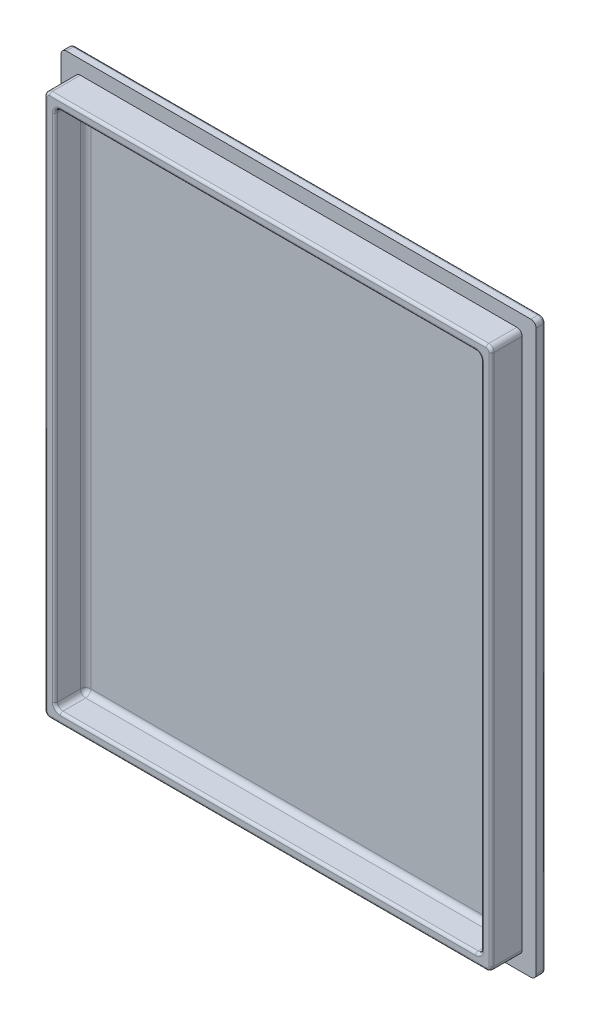
from build123d import *

# Parameters (mm, degrees)
SKETCH1_W           = 90
SKETCH1_H           = 108
BOSS_EXTRUDE1_DEPTH = 1.8
SKETCH2_W           = 84.7
SKETCH2_H           = 102.7
SKETCH2_W_2         = 80.7
SKETCH2_H_2         = 98.7
BOSS_EXTRUDE2_DEPTH = 5.8
FILLET1_R           = 1
FILLET2_R           = 0.5
CUT_EXTRUDE1_DEPTH  = 0.4


with BuildPart() as part:
    # Sketch1 → Boss-Extrude1 (new body)
    with BuildSketch(Plane.XY):
        Rectangle(SKETCH1_W, SKETCH1_H)
    extrude(amount=BOSS_EXTRUDE1_DEPTH)

    # Sketch2 → Boss-Extrude2 (add)
    with BuildSketch(Plane.XY.offset(1.8)):
        Rectangle(SKETCH2_W, SKETCH2_H)
        Rectangle(SKETCH2_W_2, SKETCH2_H_2, mode=Mode.SUBTRACT)
    extrude(amount=BOSS_EXTRUDE2_DEPTH)

    # Fillet1
    fillet1_edges = [part.edges().sort_by_distance(p)[0] for p in [
        (-40.35, 0, 1.8),
        (0, -49.35, 1.8),
        (40.35, 0, 1.8),
        (0, 49.35, 1.8),
        (-42.35, 51.35, 4.7),
        (-42.35, -51.35, 4.7),
        (42.35, -51.35, 4.7),
        (42.35, 51.35, 4.7),
        (-40.35, -49.35, 4.7),
        (40.35, -49.35, 4.7),
        (40.35, 49.35, 4.7),
        (-40.35, 49.35, 4.7),
        (45, -54, 0.9),
        (-45, -54, 0.9),
        (-45, 54, 0.9),
        (45, 54, 0.9),
    ]]
    fillet(fillet1_edges, radius=FILLET1_R)

    # Fillet2
    fillet2_edges = [part.edges().sort_by_distance(p)[0] for p in [
        (0, 49.35, 7.6),
        (40.35, 0, 7.6),
        (0, -49.35, 7.6),
        (-40.35, 0, 7.6),
        (0, -54, 0),
        (45, 0, 0),
        (-45, 0, 0),
        (0, 54, 0),
        (44.707106781, 53.707106781, 0),
        (44.707106781, -53.707106781, 0),
        (-44.707106781, 53.707106781, 0),
        (-44.707106781, -53.707106781, 0),
        (-42.35, 0, 7.6),
        (0, 51.35, 7.6),
        (0, -51.35, 7.6),
        (42.35, 0, 7.6),
        (42.057106781, 51.057106781, 7.6),
        (-42.057106781, -51.057106781, 7.6),
        (42.057106781, -51.057106781, 7.6),
        (-42.057106781, 51.057106781, 7.6),
        (40.057106781, -49.057106781, 7.6),
        (40.057106781, 49.057106781, 7.6),
        (-40.057106781, 49.057106781, 7.6),
        (-40.057106781, -49.057106781, 7.6),
    ]]
    fillet(fillet2_edges, radius=FILLET2_R)

    # Sketch3 → Cut-Extrude1 (cut)
    # profile 1 of 21: a face of its own
    with BuildSketch(Plane(origin=(0, 0, 0), x_dir=(-1, 0, 0), z_dir=(0, 0, -1))):
        with BuildLine():
            Line((-30.046875, 15.515625), (-30.046875, 11.715820313))
            add(Edge.make_bspline(
                [(-30.046875, 11.715820313), (-30.047557345, 11.636716191), (-30.048871794, 11.484332417), (-30.05548083, 11.264953882), (-30.069246102, 11.063773405), (-30.085589204, 10.877782305), (-30.112940714, 10.700218671), (-30.15008362, 10.524535589), (-30.203755596, 10.348311449), (-30.247407391, 10.232192122), (-30.26953125, 10.173339844)],
                knots=[0, 0, 0, 0, 1.210006368, 2.330919474, 3.356323987, 4.294191784, 5.185681834, 6.102709867, 7.038404292, 8, 8, 8, 8], degree=3))
            add(Edge.make_bspline(
                [(-30.26953125, 10.173339844), (-30.290338092, 10.12468765), (-30.331593248, 10.028221597), (-30.404876243, 9.890152603), (-30.489008033, 9.760522873), (-30.58269712, 9.639129424), (-30.685611034, 9.525508325), (-30.798838922, 9.421041247), (-30.92272024, 9.326318283), (-31.053992641, 9.237687704), (-31.195720277, 9.160534085), (-31.344841796, 9.090804071), (-31.503614251, 9.034506684), (-31.669918781, 8.987206239), (-31.844716369, 8.950938755), (-32.028101886, 8.92422726), (-32.220000118, 8.910313129), (-32.350566934, 8.907620077), (-32.416992187, 8.90625)],
                knots=[0, 0, 0, 0, 0.953881119, 1.891325734, 2.814479008, 3.737296314, 4.653537642, 5.575724681, 6.510892384, 7.463268797, 8.428782058, 9.417619489, 10.428630225, 11.462688628, 12.533322677, 13.645265432, 14.802039852, 16, 16, 16, 16], degree=3))
            add(Edge.make_bspline(
                [(-32.416992187, 8.90625), (-32.534785854, 8.909094695), (-32.760883214, 8.914554905), (-33.085542348, 8.95497497), (-33.379677086, 9.02433692), (-33.645019511, 9.122444802), (-33.883084533, 9.25358607), (-34.095856644, 9.419289536), (-34.284684073, 9.620731232), (-34.386512586, 9.776154768), (-34.438476562, 9.85546875)],
                knots=[0, 0, 0, 0, 1.20378012, 2.310578459, 3.337050898, 4.286231469, 5.193170284, 6.103603796, 7.032252521, 8, 8, 8, 8], degree=3))
            add(Edge.make_bspline(
                [(-34.438476562, 9.85546875), (-34.463920551, 9.903534711), (-34.515856845, 10.001646994), (-34.584907219, 10.15687609), (-34.64388007, 10.323449667), (-34.698757529, 10.496787548), (-34.739726129, 10.67431652), (-34.770992208, 10.849767363), (-34.791248266, 11.021007189), (-34.793383023, 11.134224253), (-34.794433594, 11.189941406)],
                knots=[0, 0, 0, 0, 0.935734867, 1.910022864, 2.920068211, 3.975205631, 5.037046427, 6.052390226, 7.041529002, 8, 8, 8, 8], degree=3))
            add(Edge.make_bspline(
                [(-34.794433594, 11.189941406), (-34.792578556, 11.244857696), (-34.789052635, 11.349238606), (-34.752122514, 11.495340285), (-34.690985175, 11.620870466), (-34.606374301, 11.725409805), (-34.500743751, 11.805478696), (-34.38202531, 11.865897996), (-34.248394555, 11.899646744), (-34.15545527, 11.904000083), (-34.107421875, 11.90625)],
                knots=[0, 0, 0, 0, 1.173039851, 2.229629267, 3.196748628, 4.139814058, 5.078064495, 6.012468433, 6.97279296, 8, 8, 8, 8], degree=3))
            add(Edge.make_bspline(
                [(-34.107421875, 11.90625), (-34.061803691, 11.904596289), (-33.974658017, 11.90143716), (-33.853138646, 11.869257072), (-33.748850533, 11.815200792), (-33.663143342, 11.737147007), (-33.592022485, 11.63718651), (-33.532740604, 11.514308798), (-33.479973667, 11.369060569), (-33.454449109, 11.262529301), (-33.440917969, 11.206054688)],
                knots=[0, 0, 0, 0, 1.023367024, 1.954966223, 2.799238581, 3.63850462, 4.533990685, 5.539973533, 6.695884835, 8, 8, 8, 8], degree=3))
            add(Edge.make_bspline(
                [(-33.440917969, 11.206054688), (-33.42718378, 11.144914824), (-33.401170396, 11.029112225), (-33.35762025, 10.865893274), (-33.318042144, 10.721076868), (-33.275393042, 10.593159598), (-33.225436737, 10.478674619), (-33.161392429, 10.374670133), (-33.083121465, 10.279116537), (-32.99092666, 10.191407055), (-32.879536275, 10.117675153), (-32.746132689, 10.067099929), (-32.593207248, 10.036235685), (-32.484536325, 10.032971072), (-32.427246094, 10.03125)],
                knots=[0, 0, 0, 0, 1.306183455, 2.473990433, 3.521252936, 4.435448757, 5.282948158, 6.119186039, 6.972897879, 7.851491932, 8.763418147, 9.736895206, 10.806913645, 12, 12, 12, 12], degree=3))
            add(Edge.make_bspline(
                [(-32.427246094, 10.03125), (-32.387659933, 10.032486396), (-32.311072875, 10.034878443), (-32.199531519, 10.050162936), (-32.097086909, 10.080879121), (-31.999980134, 10.11784165), (-31.912251174, 10.169828268), (-31.831846007, 10.232622181), (-31.758039178, 10.305673821), (-31.694090089, 10.391895351), (-31.635889144, 10.487495745), (-31.588594918, 10.595995186), (-31.54544516, 10.714023437), (-31.512912526, 10.844393413), (-31.484312932, 10.984948151), (-31.465874477, 11.137268742), (-31.456223585, 11.300653907), (-31.454180977, 11.413073354), (-31.453125, 11.471191406)],
                knots=[0, 0, 0, 0, 0.963361052, 1.863807676, 2.728602533, 3.560208343, 4.385341088, 5.19798089, 6.037943909, 6.902738766, 7.80318539, 8.754830499, 9.776827693, 10.857282673, 12.019774497, 13.264791246, 14.58596523, 16, 16, 16, 16], degree=3))
            Line((-31.453125, 11.471191406), (-31.453125, 15.509765625))
            add(Edge.make_bspline(
                [(-31.453125, 15.509765625), (-31.451198678, 15.579771909), (-31.447560429, 15.711992941), (-31.412453824, 15.896207675), (-31.356822294, 16.054710678), (-31.273227148, 16.183627886), (-31.168830369, 16.283627792), (-31.047011623, 16.356608249), (-30.906873086, 16.397876859), (-30.808371867, 16.403391876), (-30.757324219, 16.40625)],
                knots=[0, 0, 0, 0, 1.305302689, 2.465328236, 3.486148504, 4.421450945, 5.30454368, 6.162639947, 7.047799498, 8, 8, 8, 8], degree=3))
            add(Edge.make_bspline(
                [(-30.757324219, 16.40625), (-30.705198234, 16.404281792), (-30.604870923, 16.400493565), (-30.463804311, 16.35541414), (-30.338264323, 16.286101068), (-30.233223174, 16.185172275), (-30.147389594, 16.05737771), (-30.089109154, 15.900439469), (-30.051844022, 15.717070978), (-30.04860254, 15.585660121), (-30.046875, 15.515625)],
                knots=[0, 0, 0, 0, 0.965391849, 1.858097617, 2.723685037, 3.609584463, 4.538324685, 5.561246394, 6.700271746, 8, 8, 8, 8], degree=3))
        make_face()
    # profile 2 of 21: a face of its own
    with BuildSketch(Plane(origin=(0, 0, 0), x_dir=(-1, 0, 0), z_dir=(0, 0, -1))):
        with BuildLine():
            add(Edge.make_bspline(
                [(-25.196777344, 16.40625), (-25.103953521, 16.404946936), (-24.921943649, 16.402391876), (-24.654042029, 16.379230949), (-24.395663714, 16.344853051), (-24.14698363, 16.295369892), (-23.908618689, 16.23080155), (-23.680523501, 16.151445937), (-23.462404142, 16.057565898), (-23.254005513, 15.951003325), (-23.057616886, 15.830374847), (-22.871987867, 15.698461366), (-22.699221039, 15.553327636), (-22.538913675, 15.396247639), (-22.392088564, 15.226792777), (-22.256611177, 15.045903933), (-22.133525117, 14.852563577), (-22.024156057, 14.64681279), (-21.925895348, 14.431725901), (-21.840598478, 14.206672522), (-21.76940633, 13.972606101), (-21.710189819, 13.729138911), (-21.665309693, 13.476627294), (-21.633696839, 13.214479864), (-21.611811164, 12.943730614), (-21.610194942, 12.759810325), (-21.609375, 12.666503906)],
                knots=[0, 0, 0, 0, 1.137132438, 2.22970057, 3.292424762, 4.329649132, 5.333981859, 6.315987487, 7.286185149, 8.241436353, 9.181332131, 10.107725602, 11.0292572, 11.943085262, 12.854854597, 13.773819033, 14.709898734, 15.660115542, 16.626635295, 17.605574315, 18.606712189, 19.622473761, 20.67399022, 21.747038223, 22.857027702, 24, 24, 24, 24], degree=3))
            add(Edge.make_bspline(
                [(-21.609375, 12.666503906), (-21.612236463, 12.529681291), (-21.617850987, 12.261219335), (-21.660438971, 11.868195898), (-21.732633965, 11.494071676), (-21.830958179, 11.138998428), (-21.960192421, 10.805434355), (-22.117419853, 10.493817511), (-22.304187292, 10.205652032), (-22.518482598, 9.94119842), (-22.759486365, 9.7019547), (-23.028845105, 9.493389262), (-23.324888454, 9.315378239), (-23.644986712, 9.165436009), (-23.991057114, 9.047298892), (-24.362398942, 8.967874715), (-24.756718598, 8.913817681), (-25.028127226, 8.908817378), (-25.167480469, 8.90625)],
                knots=[0, 0, 0, 0, 1.119700056, 2.196982321, 3.230778928, 4.235358115, 5.208318876, 6.153781848, 7.087131445, 8.013361148, 8.934611457, 9.860297843, 10.794468433, 11.756326826, 12.748403726, 13.780058436, 14.860183413, 16, 16, 16, 16], degree=3))
            add(Edge.make_bspline(
                [(-25.167480469, 8.90625), (-25.305829686, 8.90958087), (-25.576673384, 8.916101654), (-25.971499241, 8.968354297), (-26.34481766, 9.052410131), (-26.69449719, 9.172594274), (-27.018095269, 9.325643475), (-27.316968746, 9.503792079), (-27.585319121, 9.714243232), (-27.826593308, 9.950989751), (-28.04077208, 10.214405028), (-28.222857641, 10.505794659), (-28.38344225, 10.818816651), (-28.510373607, 11.158114006), (-28.611361061, 11.516325766), (-28.68253515, 11.890781818), (-28.725931166, 12.279247212), (-28.73153067, 12.542855196), (-28.734375, 12.676757813)],
                knots=[0, 0, 0, 0, 1.130091603, 2.212359386, 3.247930852, 4.252250901, 5.226719473, 6.16821431, 7.089197795, 8.00610207, 8.925165125, 9.855999165, 10.808795857, 11.79501972, 12.810514548, 13.846493258, 14.906102224, 16, 16, 16, 16], degree=3))
            add(Edge.make_bspline(
                [(-28.734375, 12.676757813), (-28.731794897, 12.813123311), (-28.726721491, 13.081266672), (-28.679880961, 13.474123592), (-28.605926211, 13.850241465), (-28.500515847, 14.207726794), (-28.36686457, 14.544068229), (-28.20464001, 14.855597765), (-28.016818058, 15.141349776), (-27.80215582, 15.400780424), (-27.560312411, 15.632310235), (-27.292640828, 15.834794061), (-27.000458652, 16.008973051), (-26.683752456, 16.152238026), (-26.343963136, 16.267227072), (-25.981179063, 16.348412804), (-25.596082294, 16.397596314), (-25.332181227, 16.403315544), (-25.196777344, 16.40625)],
                knots=[0, 0, 0, 0, 1.125218611, 2.212582392, 3.260701818, 4.286054269, 5.284468473, 6.243521648, 7.180287843, 8.101949555, 9.017004541, 9.937572836, 10.866572707, 11.818894766, 12.801573564, 13.82236102, 14.882684417, 16, 16, 16, 16], degree=3))
        make_face()
        with BuildLine():
            add(Edge.make_bspline(
                [(-23.109375, 12.676757813), (-23.112239567, 12.807290522), (-23.117786032, 13.060032098), (-23.166943085, 13.425641394), (-23.246562329, 13.764762036), (-23.341458535, 14.027343783), (-23.432582367, 14.221981754), (-23.507003023, 14.357450361), (-23.587057743, 14.484987604), (-23.677918083, 14.600344408), (-23.772168099, 14.709023688), (-23.874210567, 14.808462676), (-23.984223246, 14.897180755), (-24.13838782, 15.00486256), (-24.34599589, 15.11643983), (-24.614050789, 15.21204985), (-24.899787334, 15.270968536), (-25.096394289, 15.27777485), (-25.196777344, 15.28125)],
                knots=[0, 0, 0, 0, 1.663767962, 3.22144036, 4.693807908, 6.09809827, 6.772124886, 7.43249818, 8.068074837, 8.689496673, 9.30272399, 9.901527182, 10.503429657, 11.102750509, 12.297797107, 13.495176895, 14.721094103, 16, 16, 16, 16], degree=3))
            add(Edge.make_bspline(
                [(-25.196777344, 15.28125), (-25.268683164, 15.279461327), (-25.410798157, 15.275926186), (-25.61941784, 15.242353303), (-25.819816768, 15.189848909), (-26.011062575, 15.116413025), (-26.19145206, 15.022631636), (-26.360178234, 14.908774737), (-26.515206508, 14.775285571), (-26.657404638, 14.622704684), (-26.785922851, 14.449494607), (-26.899942435, 14.253858622), (-26.99928744, 14.035794097), (-27.083982869, 13.797246773), (-27.150968666, 13.539443302), (-27.198598961, 13.265086624), (-27.228520242, 12.97575706), (-27.232394389, 12.77790652), (-27.234375, 12.676757813)],
                knots=[0, 0, 0, 0, 0.926902171, 1.831933723, 2.71800685, 3.595261319, 4.468550136, 5.334998465, 6.214894287, 7.1017058, 8.020008637, 8.99111482, 10.01694856, 11.106630737, 12.25237115, 13.448355624, 14.695502513, 16, 16, 16, 16], degree=3))
            add(Edge.make_bspline(
                [(-27.234375, 12.676757813), (-27.232388921, 12.574634374), (-27.22850333, 12.374838703), (-27.198643118, 12.082573109), (-27.150701899, 11.804885811), (-27.084194453, 11.542926095), (-26.998152674, 11.299747953), (-26.89486427, 11.077579628), (-26.779073356, 10.874836419), (-26.642473979, 10.697171482), (-26.494923833, 10.540390834), (-26.336350989, 10.403835916), (-26.167899684, 10.287505513), (-25.987956828, 10.192801372), (-25.7975089, 10.121743717), (-25.598661191, 10.067891189), (-25.390122793, 10.037132148), (-25.248143622, 10.033226935), (-25.176269531, 10.03125)],
                knots=[0, 0, 0, 0, 1.300369924, 2.54406124, 3.737115199, 4.88637188, 5.981883645, 7.016846829, 8.003376514, 8.948590554, 9.863559023, 10.741055788, 11.608647785, 12.46534091, 13.323432129, 14.192248925, 15.0848625, 16, 16, 16, 16], degree=3))
            add(Edge.make_bspline(
                [(-25.176269531, 10.03125), (-25.083697318, 10.034350516), (-24.901298636, 10.040459585), (-24.634218732, 10.097499603), (-24.379042185, 10.187181804), (-24.176997685, 10.290442989), (-24.024721749, 10.392161634), (-23.914681757, 10.477977168), (-23.812383256, 10.575631145), (-23.714874132, 10.681353913), (-23.624519148, 10.797450754), (-23.538971461, 10.922449348), (-23.459987404, 11.057686013), (-23.386913423, 11.20240464), (-23.32092258, 11.35634196), (-23.263363298, 11.519089161), (-23.217478217, 11.691361703), (-23.177430966, 11.87155969), (-23.146965096, 12.060868402), (-23.125300865, 12.25838107), (-23.111726827, 12.464653338), (-23.11017111, 12.604958952), (-23.109375, 12.676757813)],
                knots=[0, 0, 0, 0, 1.468568495, 2.893578421, 4.316075305, 5.755382189, 6.482330971, 7.222315454, 7.968369796, 8.725783183, 9.504530818, 10.302500265, 11.129737207, 11.9897977, 12.875655565, 13.787998707, 14.728608307, 15.705132475, 16.718642732, 17.771954593, 18.859838044, 20, 20, 20, 20], degree=3))
        make_face(mode=Mode.SUBTRACT)
    # profile 3 of 21: a face of its own
    with BuildSketch(Plane(origin=(0, 0, 0), x_dir=(-1, 0, 0), z_dir=(0, 0, -1))):
        with BuildLine():
            Line((-20.296875, 12.027832031), (-20.296875, 15.515625))
            add(Edge.make_bspline(
                [(-20.296875, 15.515625), (-20.295146872, 15.585659194), (-20.291904287, 15.717068313), (-20.254646403, 15.900448225), (-20.196342562, 16.057349593), (-20.110585709, 16.185265064), (-20.005897158, 16.285184075), (-19.883477802, 16.355161602), (-19.74723779, 16.400231352), (-19.650757558, 16.404204165), (-19.601074219, 16.40625)],
                knots=[0, 0, 0, 0, 1.314006093, 2.465543923, 3.499702682, 4.438645347, 5.334276599, 6.193453487, 7.069703068, 8, 8, 8, 8], degree=3))
            add(Edge.make_bspline(
                [(-19.601074219, 16.40625), (-19.549034135, 16.403455419), (-19.449054319, 16.398086448), (-19.306801493, 16.356239043), (-19.182532819, 16.284192332), (-19.076378706, 16.183727671), (-18.991638804, 16.054577579), (-18.932287764, 15.896710235), (-18.895926176, 15.712094468), (-18.892459288, 15.579774509), (-18.890625, 15.509765625)],
                knots=[0, 0, 0, 0, 0.96282878, 1.849794185, 2.716851436, 3.599658085, 4.532680285, 5.552030856, 6.704809248, 8, 8, 8, 8], degree=3))
            Line((-18.890625, 15.509765625), (-18.890625, 11.919433594))
            add(Edge.make_bspline(
                [(-18.890625, 11.919433594), (-18.88896099, 11.821235593), (-18.885776139, 11.633288482), (-18.861153533, 11.363416244), (-18.819555534, 11.1187183), (-18.760828211, 10.897681447), (-18.678607307, 10.700229845), (-18.569297614, 10.526335706), (-18.432260767, 10.376345914), (-18.297208954, 10.271477757), (-18.175605283, 10.202089325), (-18.074446639, 10.156508461), (-17.96508357, 10.116486396), (-17.845931107, 10.087122695), (-17.719499161, 10.061336401), (-17.583817451, 10.044800712), (-17.439696126, 10.031996788), (-17.340363977, 10.031502733), (-17.289550781, 10.03125)],
                knots=[0, 0, 0, 0, 1.640841622, 3.140506311, 4.523579023, 5.784571649, 6.954579444, 8.084197464, 9.198982671, 10.333306227, 10.925380769, 11.535182691, 12.185613052, 12.868404783, 13.583722754, 14.340779317, 15.151228418, 16, 16, 16, 16], degree=3))
            add(Edge.make_bspline(
                [(-17.289550781, 10.03125), (-17.219652438, 10.032488531), (-17.084856951, 10.034876977), (-16.890998029, 10.057752844), (-16.712341472, 10.09118436), (-16.55058932, 10.143143292), (-16.403631665, 10.207455987), (-16.27278386, 10.286362126), (-16.157477736, 10.380206623), (-16.058606607, 10.489666249), (-15.975165921, 10.615094367), (-15.901342478, 10.753195607), (-15.840494884, 10.90684669), (-15.789005599, 11.074238926), (-15.749767614, 11.257064412), (-15.72257464, 11.454387413), (-15.706561042, 11.666727531), (-15.704297139, 11.812959872), (-15.703125, 11.888671875)],
                knots=[0, 0, 0, 0, 1.187087794, 2.289239917, 3.312641325, 4.270309596, 5.169103343, 6.032749862, 6.858132282, 7.686303516, 8.528484611, 9.411791075, 10.342302716, 11.33164497, 12.384483705, 13.515514569, 14.713654137, 16, 16, 16, 16], degree=3))
            Line((-15.703125, 11.888671875), (-15.703125, 15.509765625))
            add(Edge.make_bspline(
                [(-15.703125, 15.509765625), (-15.701152924, 15.58071911), (-15.697452358, 15.713862034), (-15.663337742, 15.899799065), (-15.603711168, 16.056902331), (-15.519877824, 16.185081109), (-15.416203048, 16.286081405), (-15.292874569, 16.354713587), (-15.155530557, 16.400621444), (-15.058014651, 16.404324887), (-15.007324219, 16.40625)],
                knots=[0, 0, 0, 0, 1.324209478, 2.484855026, 3.512713035, 4.440887327, 5.324452051, 6.186293477, 7.057204391, 8, 8, 8, 8], degree=3))
            add(Edge.make_bspline(
                [(-15.007324219, 16.40625), (-14.956671237, 16.404202394), (-14.858292888, 16.400225529), (-14.719194495, 16.355185457), (-14.594438226, 16.285696562), (-14.487288029, 16.186407102), (-14.398792471, 16.059395029), (-14.338347826, 15.901296805), (-14.302150757, 15.716002986), (-14.298704393, 15.583193193), (-14.296875, 15.512695313)],
                knots=[0, 0, 0, 0, 0.937671153, 1.821147261, 2.686184232, 3.571984669, 4.510357278, 5.535961965, 6.692043289, 8, 8, 8, 8], degree=3))
            Line((-14.296875, 15.512695313), (-14.296875, 12.01171875))
            add(Edge.make_bspline(
                [(-14.296875, 12.01171875), (-14.298847418, 11.875440511), (-14.302634598, 11.613776875), (-14.331025919, 11.238859506), (-14.380669028, 10.899209785), (-14.447767244, 10.590603142), (-14.545113897, 10.307585952), (-14.678978125, 10.045710465), (-14.8472184, 9.800451933), (-14.984745128, 9.655972949), (-15.054199219, 9.583007812)],
                knots=[0, 0, 0, 0, 1.248457049, 2.397123805, 3.441600438, 4.391152342, 5.286682789, 6.174943873, 7.078305605, 8, 8, 8, 8], degree=3))
            add(Edge.make_bspline(
                [(-15.054199219, 9.583007812), (-15.120850225, 9.526699466), (-15.253996226, 9.414214574), (-15.4758685, 9.2744411), (-15.711986229, 9.155694832), (-15.965597237, 9.06195424), (-16.238167591, 8.991788363), (-16.53129762, 8.943057854), (-16.845996679, 8.911603727), (-17.063397501, 8.908069206), (-17.175292969, 8.90625)],
                knots=[0, 0, 0, 0, 0.917673777, 1.83319953, 2.752815171, 3.696261941, 4.673826777, 5.7116717, 6.822205161, 8, 8, 8, 8], degree=3))
            add(Edge.make_bspline(
                [(-17.175292969, 8.90625), (-17.308186532, 8.908418141), (-17.564660384, 8.91260248), (-17.93511442, 8.946819482), (-18.27736461, 9.000763176), (-18.59120097, 9.079938307), (-18.878262837, 9.181043198), (-19.135648971, 9.311731691), (-19.369128309, 9.462019208), (-19.572900799, 9.641592073), (-19.750514215, 9.846119646), (-19.903066164, 10.076717487), (-20.026178722, 10.335476681), (-20.128810633, 10.619242222), (-20.202434746, 10.93170181), (-20.258734422, 11.271218718), (-20.289861091, 11.640049288), (-20.294480639, 11.895453394), (-20.296875, 12.027832031)],
                knots=[0, 0, 0, 0, 1.244583114, 2.401944964, 3.48169555, 4.486712429, 5.430003149, 6.325898902, 7.184706889, 8.024138875, 8.860562605, 9.715550095, 10.605366032, 11.538500779, 12.536866304, 13.60758979, 14.759988597, 16, 16, 16, 16], degree=3))
        make_face()
    # profile 4 of 21: a face of its own
    with BuildSketch(Plane(origin=(0, 0, 0), x_dir=(-1, 0, 0), z_dir=(0, 0, -1))):
        with BuildLine():
            Line((-11.296875, 15.512695313), (-11.296875, 10.21875))
            Line((-11.296875, 10.21875), (-8.3203125, 10.21875))
            add(Edge.make_bspline(
                [(-8.3203125, 10.21875), (-8.264431535, 10.2172871), (-8.157869972, 10.21449744), (-8.008886269, 10.180012338), (-7.878365392, 10.126654826), (-7.772834862, 10.047307781), (-7.687774219, 9.954500459), (-7.6259966, 9.848349045), (-7.589861841, 9.729833876), (-7.585649643, 9.647218716), (-7.583496094, 9.604980469)],
                knots=[0, 0, 0, 0, 1.240270116, 2.365118784, 3.381765818, 4.352609133, 5.275186246, 6.165500839, 7.062084633, 8, 8, 8, 8], degree=3))
            add(Edge.make_bspline(
                [(-7.583496094, 9.604980469), (-7.585561979, 9.561752756), (-7.589558199, 9.478133635), (-7.626039798, 9.358706914), (-7.687084611, 9.253351492), (-7.771067036, 9.162506629), (-7.87646589, 9.087417874), (-8.006390887, 9.037559482), (-8.156046934, 9.004345058), (-8.263463127, 9.001503747), (-8.3203125, 9)],
                knots=[0, 0, 0, 0, 0.961785517, 1.860465312, 2.752861249, 3.654173772, 4.599371787, 5.609990076, 6.735101654, 8, 8, 8, 8], degree=3))
            Line((-8.3203125, 9), (-11.841796875, 9))
            add(Edge.make_bspline(
                [(-11.841796875, 9), (-11.913358444, 9.001872359), (-12.046633409, 9.005359406), (-12.230453231, 9.047257735), (-12.384993007, 9.111499373), (-12.508127522, 9.209140298), (-12.598882716, 9.339200098), (-12.660985106, 9.499737551), (-12.69609223, 9.691860425), (-12.700673411, 9.829924512), (-12.703125, 9.903808594)],
                knots=[0, 0, 0, 0, 1.184943227, 2.206816713, 3.109923682, 3.939837529, 4.776053014, 5.71019795, 6.774627611, 8, 8, 8, 8], degree=3))
            Line((-12.703125, 9.903808594), (-12.703125, 15.512695313))
            add(Edge.make_bspline(
                [(-12.703125, 15.512695313), (-12.701313102, 15.582702669), (-12.697900936, 15.714540511), (-12.661556645, 15.898264986), (-12.601718154, 16.054882387), (-12.517464455, 16.183837463), (-12.411607777, 16.283266003), (-12.290494557, 16.355976546), (-12.153046921, 16.397838828), (-12.056921996, 16.403387197), (-12.007324219, 16.40625)],
                knots=[0, 0, 0, 0, 1.312227502, 2.471186598, 3.495416453, 4.440711492, 5.33513045, 6.197779038, 7.0701043, 8, 8, 8, 8], degree=3))
            add(Edge.make_bspline(
                [(-12.007324219, 16.40625), (-11.956671214, 16.404202398), (-11.858292822, 16.400225541), (-11.71919474, 16.355185411), (-11.594437315, 16.285696733), (-11.487291612, 16.18640643), (-11.39877766, 16.059397807), (-11.338584055, 15.901735353), (-11.301906674, 15.716533127), (-11.298627552, 15.583692843), (-11.296875, 15.512695313)],
                knots=[0, 0, 0, 0, 0.937651975, 1.821110013, 2.686129292, 3.571911612, 4.510265029, 5.535848738, 6.683015045, 8, 8, 8, 8], degree=3))
        make_face()
    # profile 5 of 21: a face of its own
    with BuildSketch(Plane(origin=(0, 0, 0), x_dir=(-1, 0, 0), z_dir=(0, 0, -1))):
        with BuildLine():
            Line((-1.801757812, 15.09375), (-5.109375, 15.09375))
            Line((-5.109375, 15.09375), (-5.109375, 13.3125))
            Line((-5.109375, 13.3125), (-2.063964844, 13.3125))
            add(Edge.make_bspline(
                [(-2.063964844, 13.3125), (-2.011117234, 13.310499943), (-1.911919206, 13.306745721), (-1.773060758, 13.28019061), (-1.655625248, 13.231450001), (-1.560086538, 13.163434108), (-1.486712377, 13.07883871), (-1.432775125, 12.982400204), (-1.401242348, 12.872030031), (-1.397790918, 12.794639441), (-1.395996094, 12.754394531)],
                knots=[0, 0, 0, 0, 1.285293232, 2.412569968, 3.418386025, 4.354403319, 5.23810445, 6.120527863, 7.022630715, 8, 8, 8, 8], degree=3))
            add(Edge.make_bspline(
                [(-1.395996094, 12.754394531), (-1.397740492, 12.714124963), (-1.401094955, 12.636686953), (-1.433363054, 12.526458578), (-1.485309265, 12.427993789), (-1.557981242, 12.341619138), (-1.652728898, 12.271095052), (-1.770462135, 12.221139358), (-1.91029866, 12.192864126), (-2.010606243, 12.189362623), (-2.063964844, 12.1875)],
                knots=[0, 0, 0, 0, 0.971200242, 1.867609123, 2.749214551, 3.645234956, 4.57279535, 5.576919765, 6.711042891, 8, 8, 8, 8], degree=3))
            Line((-2.063964844, 12.1875), (-5.109375, 12.1875))
            Line((-5.109375, 12.1875), (-5.109375, 10.125))
            Line((-5.109375, 10.125), (-1.6875, 10.125))
            add(Edge.make_bspline(
                [(-1.6875, 10.125), (-1.63319901, 10.122968169), (-1.531118955, 10.119148545), (-1.387236267, 10.092772064), (-1.265305119, 10.042668469), (-1.164619379, 9.974077008), (-1.085050695, 9.889889618), (-1.030320035, 9.789782074), (-0.994768837, 9.678161067), (-0.991775762, 9.598915633), (-0.990234375, 9.558105469)],
                knots=[0, 0, 0, 0, 1.281412047, 2.408917619, 3.431661904, 4.368016538, 5.264760761, 6.136510243, 7.040331808, 8, 8, 8, 8], degree=3))
            add(Edge.make_bspline(
                [(-0.990234375, 9.558105469), (-0.991695332, 9.518240316), (-0.994514505, 9.441313508), (-1.030961541, 9.332899099), (-1.085446328, 9.234851522), (-1.164635373, 9.151028698), (-1.264965997, 9.081915175), (-1.38780435, 9.034572721), (-1.530847587, 9.005149913), (-1.633138565, 9.00178712), (-1.6875, 9)],
                knots=[0, 0, 0, 0, 0.944744106, 1.823049547, 2.692159438, 3.596595969, 4.540982691, 5.5681055, 6.707595947, 8, 8, 8, 8], degree=3))
            Line((-1.6875, 9), (-5.654296875, 9))
            add(Edge.make_bspline(
                [(-5.654296875, 9), (-5.725804653, 9.002080975), (-5.858872775, 9.00595344), (-6.043237929, 9.045290679), (-6.196909912, 9.110355932), (-6.321118482, 9.206076585), (-6.410913531, 9.336057185), (-6.473605385, 9.495218651), (-6.508568697, 9.686014754), (-6.513164554, 9.823096217), (-6.515625, 9.896484375)],
                knots=[0, 0, 0, 0, 1.189456171, 2.21344733, 3.119993849, 3.948013107, 4.78741338, 5.71757596, 6.778077714, 8, 8, 8, 8], degree=3))
            Line((-6.515625, 9.896484375), (-6.515625, 15.322265625))
            add(Edge.make_bspline(
                [(-6.515625, 15.322265625), (-6.514498817, 15.372605022), (-6.512360321, 15.46819391), (-6.496454894, 15.604644771), (-6.469392192, 15.726808639), (-6.429578673, 15.835249068), (-6.378749492, 15.93069899), (-6.312831114, 16.011481764), (-6.234050694, 16.077882297), (-6.143064409, 16.131754914), (-6.038548521, 16.170273646), (-5.92238, 16.200242008), (-5.792375128, 16.215198207), (-5.701689441, 16.217530919), (-5.654296875, 16.21875)],
                knots=[0, 0, 0, 0, 1.257097402, 2.387087425, 3.425508426, 4.374733264, 5.264346199, 6.113849079, 6.961774747, 7.825601221, 8.740599092, 9.73444991, 10.816017894, 12, 12, 12, 12], degree=3))
            Line((-5.654296875, 16.21875), (-1.801757812, 16.21875))
            add(Edge.make_bspline(
                [(-1.801757812, 16.21875), (-1.746987064, 16.216675053), (-1.643973643, 16.212772469), (-1.499335979, 16.187060865), (-1.378191279, 16.136257484), (-1.278484892, 16.068399777), (-1.20349846, 15.982992088), (-1.146534527, 15.886703102), (-1.114158188, 15.776432588), (-1.110673924, 15.698932363), (-1.108886719, 15.659179688)],
                knots=[0, 0, 0, 0, 1.304353081, 2.453241492, 3.474309848, 4.409392115, 5.298405909, 6.157667996, 7.055001114, 8, 8, 8, 8], degree=3))
            add(Edge.make_bspline(
                [(-1.108886719, 15.659179688), (-1.110604123, 15.618429598), (-1.113933066, 15.539441392), (-1.146973229, 15.427123703), (-1.202528613, 15.328430167), (-1.278639472, 15.242803261), (-1.377827533, 15.174443463), (-1.499743128, 15.125921841), (-1.643906037, 15.099570674), (-1.746963596, 15.095770499), (-1.801757812, 15.09375)],
                knots=[0, 0, 0, 0, 0.962139494, 1.864969442, 2.738963821, 3.622448103, 4.551714319, 5.562017248, 6.70375977, 8, 8, 8, 8], degree=3))
        make_face()
    # profile 6 of 21: a face of its own
    with BuildSketch(Plane(origin=(0, 0, 0), x_dir=(-1, 0, 0), z_dir=(0, 0, -1))):
        with BuildLine():
            Line((2.620605469, 10.117675781), (1.453125, 14.71875))
            Line((1.453125, 14.71875), (1.453125, 9.733886719))
            add(Edge.make_bspline(
                [(1.453125, 9.733886719), (1.451163245, 9.668749835), (1.447489199, 9.54675912), (1.413188001, 9.376307142), (1.359724399, 9.229820408), (1.278169338, 9.111056582), (1.179056204, 9.019120919), (1.064297993, 8.952094058), (0.933569679, 8.913493944), (0.84156456, 8.908720566), (0.793945313, 8.90625)],
                knots=[0, 0, 0, 0, 1.30362474, 2.441475632, 3.469867302, 4.406120522, 5.299256138, 6.158467928, 7.046875082, 8, 8, 8, 8], degree=3))
            add(Edge.make_bspline(
                [(0.793945313, 8.90625), (0.747757565, 8.908691748), (0.658092932, 8.913431931), (0.53054656, 8.953024995), (0.416284895, 9.01744071), (0.3164592, 9.108150803), (0.236686715, 9.22661659), (0.179180559, 9.371198343), (0.14672024, 9.542034987), (0.14274126, 9.664407277), (0.140625, 9.729492188)],
                knots=[0, 0, 0, 0, 0.931401934, 1.808137819, 2.66942439, 3.563139973, 4.50699297, 5.529036112, 6.685793447, 8, 8, 8, 8], degree=3))
            Line((0.140625, 9.729492188), (0.140625, 15.418945313))
            add(Edge.make_bspline(
                [(0.140625, 15.418945313), (0.141693797, 15.456558044), (0.143752136, 15.528994375), (0.153062178, 15.633065928), (0.172013883, 15.727933602), (0.199571614, 15.812328663), (0.234034786, 15.887490257), (0.274334833, 15.954215578), (0.324765517, 16.010520765), (0.403666005, 16.072024018), (0.518850908, 16.131811318), (0.675139918, 16.183106114), (0.852346815, 16.213569174), (0.977415483, 16.216968358), (1.04296875, 16.21875)],
                knots=[0, 0, 0, 0, 0.969665939, 1.867427353, 2.689218696, 3.457225703, 4.149776576, 4.816702983, 5.458338976, 6.085245707, 7.385799533, 8.77853966, 10.311509556, 12, 12, 12, 12], degree=3))
            Line((1.04296875, 16.21875), (1.492675781, 16.21875))
            add(Edge.make_bspline(
                [(1.492675781, 16.21875), (1.555677503, 16.217971496), (1.672566568, 16.216527112), (1.83389565, 16.204737268), (1.96732963, 16.181599944), (2.076809289, 16.150567842), (2.166381792, 16.104119941), (2.242333431, 16.045333315), (2.304916433, 15.969966516), (2.3557128, 15.877376607), (2.401037923, 15.763023607), (2.448342329, 15.622257402), (2.501671384, 15.45270676), (2.534255783, 15.328774602), (2.551757813, 15.262207031)],
                knots=[0, 0, 0, 0, 1.38803647, 2.575267475, 3.558583177, 4.368440808, 5.070869684, 5.768090105, 6.470518981, 7.212366556, 8.085347214, 9.177334938, 10.483864409, 12, 12, 12, 12], degree=3))
            Line((2.551757813, 15.262207031), (3.609375, 11.34375))
            Line((3.609375, 11.34375), (4.653808594, 15.262207031))
            add(Edge.make_bspline(
                [(4.653808594, 15.262207031), (4.671317323, 15.328770732), (4.703914195, 15.452695686), (4.75716393, 15.622292141), (4.804698511, 15.762925406), (4.849475473, 15.877873383), (4.902339556, 15.969556591), (4.964597525, 16.045395996), (5.040682503, 16.104082726), (5.130604019, 16.150877797), (5.241225087, 16.181498062), (5.376063462, 16.204749313), (5.538377211, 16.216479717), (5.655749899, 16.217957042), (5.71875, 16.21875)],
                knots=[0, 0, 0, 0, 1.511478991, 2.813995637, 3.902629473, 4.772928891, 5.517843496, 6.218114959, 6.913193965, 7.613465427, 8.431097637, 9.421953472, 10.616226692, 12, 12, 12, 12], degree=3))
            Line((5.71875, 16.21875), (6.169921875, 16.21875))
            add(Edge.make_bspline(
                [(6.169921875, 16.21875), (6.235956364, 16.216950866), (6.361981491, 16.213517264), (6.54025294, 16.183333312), (6.69689661, 16.131736577), (6.812346217, 16.072190372), (6.890990536, 16.010039501), (6.943209495, 15.954821325), (6.982720004, 15.886998806), (7.020108526, 15.813074532), (7.044181057, 15.727349105), (7.066445378, 15.633358422), (7.07478089, 15.528940032), (7.076982045, 15.45653947), (7.078125, 15.418945313)],
                knots=[0, 0, 0, 0, 1.69575107, 3.236297379, 4.624693315, 5.921190494, 6.546141798, 7.194208304, 7.859054455, 8.55478081, 9.316580419, 10.138397467, 11.033358612, 12, 12, 12, 12], degree=3))
            Line((7.078125, 15.418945313), (7.078125, 9.729492188))
            add(Edge.make_bspline(
                [(7.078125, 9.729492188), (7.076107366, 9.664858098), (7.072315375, 9.543383206), (7.03853212, 9.373712308), (6.984250429, 9.228107989), (6.903657988, 9.109583151), (6.803315588, 9.018746296), (6.687781664, 8.952068927), (6.555608252, 8.913503207), (6.462653721, 8.908723464), (6.414550781, 8.90625)],
                knots=[0, 0, 0, 0, 1.293518314, 2.431070022, 3.450077594, 4.386084638, 5.272371044, 6.139835868, 7.037385671, 8, 8, 8, 8], degree=3))
            add(Edge.make_bspline(
                [(6.414550781, 8.90625), (6.368866709, 8.908724674), (6.280189056, 8.913528281), (6.153576632, 8.952740898), (6.040971474, 9.019548319), (5.941913604, 9.110978892), (5.860821246, 9.230147755), (5.805085669, 9.37592739), (5.77141664, 9.546821252), (5.767641001, 9.668771463), (5.765625, 9.733886719)],
                knots=[0, 0, 0, 0, 0.922456205, 1.790585791, 2.649061979, 3.550299627, 4.495046019, 5.536376652, 6.684549498, 8, 8, 8, 8], degree=3))
            Line((5.765625, 9.733886719), (5.765625, 14.71875))
            Line((5.765625, 14.71875), (4.598144531, 10.117675781))
            add(Edge.make_bspline(
                [(4.598144531, 10.117675781), (4.580370765, 10.047775507), (4.547357379, 9.917941188), (4.497347939, 9.738885251), (4.452955389, 9.589626032), (4.415884391, 9.463760192), (4.370016012, 9.355500603), (4.311276125, 9.256212492), (4.234237503, 9.164124221), (4.147418805, 9.074142727), (4.040485957, 8.997614758), (3.913257449, 8.943411191), (3.767236728, 8.910972097), (3.663752659, 8.907876592), (3.609375, 8.90625)],
                knots=[0, 0, 0, 0, 1.501096557, 2.788170037, 3.868651286, 4.742863802, 5.516817816, 6.309819568, 7.133547599, 8.010237478, 8.906902995, 9.849006967, 10.869720086, 12, 12, 12, 12], degree=3))
            add(Edge.make_bspline(
                [(3.609375, 8.90625), (3.567776148, 8.907648329), (3.487461146, 8.910348087), (3.372227979, 8.931233613), (3.266244848, 8.964636329), (3.17086198, 9.013509138), (3.086090943, 9.073430603), (3.012224925, 9.14262275), (2.945330855, 9.216229389), (2.873214575, 9.328753833), (2.79971396, 9.483388771), (2.734581194, 9.685116273), (2.680839922, 9.899229464), (2.640915015, 10.044021164), (2.620605469, 10.117675781)],
                knots=[0, 0, 0, 0, 0.868933015, 1.67765103, 2.439282522, 3.183205666, 3.908055228, 4.601401517, 5.295498424, 5.980457608, 7.386244959, 8.861049734, 10.403235965, 12, 12, 12, 12], degree=3))
        make_face()
    # profile 7 of 21: a face of its own
    with BuildSketch(Plane(origin=(0, 0, 0), x_dir=(-1, 0, 0), z_dir=(0, 0, -1))):
        with BuildLine():
            Line((13.385742188, 15.09375), (10.078125, 15.09375))
            Line((10.078125, 15.09375), (10.078125, 13.3125))
            Line((10.078125, 13.3125), (13.123535156, 13.3125))
            add(Edge.make_bspline(
                [(13.123535156, 13.3125), (13.176382766, 13.310499943), (13.275580794, 13.306745721), (13.414439242, 13.28019061), (13.531874752, 13.231450001), (13.627413462, 13.163434108), (13.700787623, 13.07883871), (13.754724875, 12.982400204), (13.786257652, 12.872030031), (13.789709082, 12.794639441), (13.791503906, 12.754394531)],
                knots=[0, 0, 0, 0, 1.285293232, 2.412569968, 3.418386025, 4.354403319, 5.23810445, 6.120527863, 7.022630715, 8, 8, 8, 8], degree=3))
            add(Edge.make_bspline(
                [(13.791503906, 12.754394531), (13.789759508, 12.714124963), (13.786405045, 12.636686953), (13.754136946, 12.526458578), (13.702190735, 12.427993789), (13.629518758, 12.341619138), (13.534771102, 12.271095052), (13.417037865, 12.221139358), (13.27720134, 12.192864126), (13.176893757, 12.189362623), (13.123535156, 12.1875)],
                knots=[0, 0, 0, 0, 0.971200242, 1.867609123, 2.749214551, 3.645234956, 4.57279535, 5.576919765, 6.711042891, 8, 8, 8, 8], degree=3))
            Line((13.123535156, 12.1875), (10.078125, 12.1875))
            Line((10.078125, 12.1875), (10.078125, 10.125))
            Line((10.078125, 10.125), (13.5, 10.125))
            add(Edge.make_bspline(
                [(13.5, 10.125), (13.55430099, 10.122968169), (13.656381045, 10.119148545), (13.800263733, 10.092772064), (13.922194881, 10.042668469), (14.022880621, 9.974077008), (14.102449305, 9.889889618), (14.157179965, 9.789782074), (14.192731163, 9.678161067), (14.195724238, 9.598915633), (14.197265625, 9.558105469)],
                knots=[0, 0, 0, 0, 1.281412047, 2.408917619, 3.431661904, 4.368016538, 5.264760761, 6.136510243, 7.040331808, 8, 8, 8, 8], degree=3))
            add(Edge.make_bspline(
                [(14.197265625, 9.558105469), (14.195804668, 9.518240316), (14.192985495, 9.441313508), (14.156538459, 9.332899099), (14.102053672, 9.234851522), (14.022864627, 9.151028698), (13.922534003, 9.081915175), (13.79969565, 9.034572721), (13.656652413, 9.005149913), (13.554361435, 9.00178712), (13.5, 9)],
                knots=[0, 0, 0, 0, 0.944744106, 1.823049547, 2.692159438, 3.596595969, 4.540982691, 5.5681055, 6.707595947, 8, 8, 8, 8], degree=3))
            Line((13.5, 9), (9.533203125, 9))
            add(Edge.make_bspline(
                [(9.533203125, 9), (9.461695347, 9.002080975), (9.328627225, 9.00595344), (9.144262071, 9.045290679), (8.990590088, 9.110355932), (8.866381518, 9.206076585), (8.776586469, 9.336057185), (8.713894615, 9.495218651), (8.678931303, 9.686014754), (8.674335446, 9.823096217), (8.671875, 9.896484375)],
                knots=[0, 0, 0, 0, 1.189456171, 2.21344733, 3.119993849, 3.948013107, 4.78741338, 5.71757596, 6.778077714, 8, 8, 8, 8], degree=3))
            Line((8.671875, 9.896484375), (8.671875, 15.322265625))
            add(Edge.make_bspline(
                [(8.671875, 15.322265625), (8.673001183, 15.372605022), (8.675139679, 15.46819391), (8.691045106, 15.604644771), (8.718107808, 15.726808639), (8.757921327, 15.835249068), (8.808750508, 15.93069899), (8.874668886, 16.011481764), (8.953449306, 16.077882297), (9.044435591, 16.131754914), (9.148951479, 16.170273646), (9.26512, 16.200242008), (9.395124872, 16.215198207), (9.485810559, 16.217530919), (9.533203125, 16.21875)],
                knots=[0, 0, 0, 0, 1.257097402, 2.387087425, 3.425508426, 4.374733264, 5.264346199, 6.113849079, 6.961774747, 7.825601221, 8.740599092, 9.73444991, 10.816017894, 12, 12, 12, 12], degree=3))
            Line((9.533203125, 16.21875), (13.385742188, 16.21875))
            add(Edge.make_bspline(
                [(13.385742188, 16.21875), (13.440512936, 16.216675053), (13.543526357, 16.212772469), (13.688164021, 16.187060865), (13.809308721, 16.136257484), (13.909015108, 16.068399777), (13.98400154, 15.982992088), (14.040965473, 15.886703102), (14.073341812, 15.776432588), (14.076826076, 15.698932363), (14.078613281, 15.659179688)],
                knots=[0, 0, 0, 0, 1.304353081, 2.453241492, 3.474309848, 4.409392115, 5.298405909, 6.157667996, 7.055001114, 8, 8, 8, 8], degree=3))
            add(Edge.make_bspline(
                [(14.078613281, 15.659179688), (14.076895877, 15.618429598), (14.073566934, 15.539441392), (14.040526771, 15.427123703), (13.984971387, 15.328430167), (13.908860528, 15.242803261), (13.809672467, 15.174443463), (13.687756872, 15.125921841), (13.543593963, 15.099570674), (13.440536404, 15.095770499), (13.385742188, 15.09375)],
                knots=[0, 0, 0, 0, 0.962139494, 1.864969442, 2.738963821, 3.622448103, 4.551714319, 5.562017248, 6.70375977, 8, 8, 8, 8], degree=3))
        make_face()
    # profile 8 of 21: a face of its own
    with BuildSketch(Plane(origin=(0, 0, 0), x_dir=(-1, 0, 0), z_dir=(0, 0, -1))):
        with BuildLine():
            Line((20.022949219, 15), (18.421875, 15))
            Line((18.421875, 15), (18.421875, 9.791015625))
            add(Edge.make_bspline(
                [(18.421875, 9.791015625), (18.42013939, 9.720502201), (18.416893297, 9.588621684), (18.379957653, 9.404442133), (18.320135412, 9.247961374), (18.23301535, 9.121629325), (18.12741025, 9.024345632), (18.005461745, 8.955676441), (17.869046456, 8.912662506), (17.77278867, 8.908431899), (17.723144531, 8.90625)],
                knots=[0, 0, 0, 0, 1.324771526, 2.4777063, 3.516495944, 4.454151167, 5.338361256, 6.19400724, 7.068574513, 8, 8, 8, 8], degree=3))
            add(Edge.make_bspline(
                [(17.723144531, 8.90625), (17.672946266, 8.908241834), (17.575458722, 8.912110075), (17.438028731, 8.957982904), (17.312732282, 9.02502933), (17.2062143, 9.124797356), (17.117461868, 9.250929396), (17.05960542, 9.408332743), (17.02015072, 9.590329257), (17.017194286, 9.721427959), (17.015625, 9.791015625)],
                knots=[0, 0, 0, 0, 0.936591527, 1.818907611, 2.686883908, 3.580272073, 4.52668274, 5.549195867, 6.699104295, 8, 8, 8, 8], degree=3))
            Line((17.015625, 9.791015625), (17.015625, 15))
            Line((17.015625, 15), (15.413085938, 15))
            add(Edge.make_bspline(
                [(15.413085938, 15), (15.354286516, 15.001459012), (15.243966762, 15.004196417), (15.090850142, 15.037361517), (14.959444146, 15.087176836), (14.853117854, 15.162113809), (14.771755817, 15.254269878), (14.712330046, 15.359877437), (14.678512157, 15.479414633), (14.674130978, 15.563267432), (14.671875, 15.606445313)],
                knots=[0, 0, 0, 0, 1.298175259, 2.435642608, 3.448405227, 4.386245553, 5.281324188, 6.14672195, 7.045701294, 8, 8, 8, 8], degree=3))
            add(Edge.make_bspline(
                [(14.671875, 15.606445313), (14.673753122, 15.651668832), (14.677374715, 15.738873556), (14.715631041, 15.861081306), (14.775170078, 15.969153761), (14.860783705, 16.059266135), (14.968331929, 16.132486453), (15.098519699, 16.182912139), (15.249041324, 16.213880202), (15.356277809, 16.217063604), (15.413085938, 16.21875)],
                knots=[0, 0, 0, 0, 0.993926626, 1.916593339, 2.793690024, 3.692250099, 4.629614642, 5.63892321, 6.749228366, 8, 8, 8, 8], degree=3))
            Line((15.413085938, 16.21875), (20.022949219, 16.21875))
            add(Edge.make_bspline(
                [(20.022949219, 16.21875), (20.082711742, 16.217237573), (20.194939809, 16.214397386), (20.35079043, 16.181868084), (20.483924082, 16.130530466), (20.589673183, 16.053115831), (20.673856551, 15.961977628), (20.731619166, 15.854405284), (20.768492091, 15.734811641), (20.772396139, 15.650186389), (20.774414063, 15.606445313)],
                knots=[0, 0, 0, 0, 1.304496451, 2.449714448, 3.464685333, 4.39788137, 5.28974218, 6.154486031, 7.046091257, 8, 8, 8, 8], degree=3))
            add(Edge.make_bspline(
                [(20.774414063, 15.606445313), (20.772290521, 15.563235194), (20.768159764, 15.479181967), (20.732362798, 15.359728783), (20.67153107, 15.254179077), (20.588670058, 15.162052126), (20.480897807, 15.08718204), (20.347638554, 15.037139931), (20.192983617, 15.004460517), (20.081734147, 15.001542107), (20.022949219, 15)],
                knots=[0, 0, 0, 0, 0.94771637, 1.843517728, 2.708217129, 3.604275273, 4.544436114, 5.560171289, 6.710778986, 8, 8, 8, 8], degree=3))
        make_face()
    # profile 9 of 21: a face of its own
    with BuildSketch(Plane(origin=(0, 0, 0), x_dir=(-1, 0, 0), z_dir=(0, 0, -1))):
        with BuildLine():
            Line((26.510742188, 15.09375), (23.203125, 15.09375))
            Line((23.203125, 15.09375), (23.203125, 13.3125))
            Line((23.203125, 13.3125), (26.248535156, 13.3125))
            add(Edge.make_bspline(
                [(26.248535156, 13.3125), (26.301382766, 13.310499943), (26.400580794, 13.306745721), (26.539439242, 13.28019061), (26.656874752, 13.231450001), (26.752413462, 13.163434108), (26.825787623, 13.07883871), (26.879724875, 12.982400204), (26.911257652, 12.872030031), (26.914709082, 12.794639441), (26.916503906, 12.754394531)],
                knots=[0, 0, 0, 0, 1.285293232, 2.412569968, 3.418386025, 4.354403319, 5.23810445, 6.120527863, 7.022630715, 8, 8, 8, 8], degree=3))
            add(Edge.make_bspline(
                [(26.916503906, 12.754394531), (26.914759508, 12.714124963), (26.911405045, 12.636686953), (26.879136946, 12.526458578), (26.827190735, 12.427993789), (26.754518758, 12.341619138), (26.659771102, 12.271095052), (26.542037865, 12.221139358), (26.40220134, 12.192864126), (26.301893757, 12.189362623), (26.248535156, 12.1875)],
                knots=[0, 0, 0, 0, 0.971200242, 1.867609123, 2.749214551, 3.645234956, 4.57279535, 5.576919765, 6.711042891, 8, 8, 8, 8], degree=3))
            Line((26.248535156, 12.1875), (23.203125, 12.1875))
            Line((23.203125, 12.1875), (23.203125, 10.125))
            Line((23.203125, 10.125), (26.625, 10.125))
            add(Edge.make_bspline(
                [(26.625, 10.125), (26.67930099, 10.122968169), (26.781381045, 10.119148545), (26.925263733, 10.092772064), (27.047194881, 10.042668469), (27.147880621, 9.974077008), (27.227449305, 9.889889618), (27.282179965, 9.789782074), (27.317731163, 9.678161067), (27.320724238, 9.598915633), (27.322265625, 9.558105469)],
                knots=[0, 0, 0, 0, 1.281412047, 2.408917619, 3.431661904, 4.368016538, 5.264760761, 6.136510243, 7.040331808, 8, 8, 8, 8], degree=3))
            add(Edge.make_bspline(
                [(27.322265625, 9.558105469), (27.320804668, 9.518240316), (27.317985495, 9.441313508), (27.281538459, 9.332899099), (27.227053672, 9.234851522), (27.147864627, 9.151028698), (27.047534003, 9.081915175), (26.92469565, 9.034572721), (26.781652413, 9.005149913), (26.679361435, 9.00178712), (26.625, 9)],
                knots=[0, 0, 0, 0, 0.944744106, 1.823049547, 2.692159438, 3.596595969, 4.540982691, 5.5681055, 6.707595947, 8, 8, 8, 8], degree=3))
            Line((26.625, 9), (22.658203125, 9))
            add(Edge.make_bspline(
                [(22.658203125, 9), (22.586695347, 9.002080975), (22.453627225, 9.00595344), (22.269262071, 9.045290679), (22.115590088, 9.110355932), (21.991381518, 9.206076585), (21.901586469, 9.336057185), (21.838894615, 9.495218651), (21.803931303, 9.686014754), (21.799335446, 9.823096217), (21.796875, 9.896484375)],
                knots=[0, 0, 0, 0, 1.189456171, 2.21344733, 3.119993849, 3.948013107, 4.78741338, 5.71757596, 6.778077714, 8, 8, 8, 8], degree=3))
            Line((21.796875, 9.896484375), (21.796875, 15.322265625))
            add(Edge.make_bspline(
                [(21.796875, 15.322265625), (21.798001183, 15.372605022), (21.800139679, 15.46819391), (21.816045106, 15.604644771), (21.843107808, 15.726808639), (21.882921327, 15.835249068), (21.933750508, 15.93069899), (21.999668886, 16.011481764), (22.078449306, 16.077882297), (22.169435591, 16.131754914), (22.273951479, 16.170273646), (22.39012, 16.200242008), (22.520124872, 16.215198207), (22.610810559, 16.217530919), (22.658203125, 16.21875)],
                knots=[0, 0, 0, 0, 1.257097402, 2.387087425, 3.425508426, 4.374733264, 5.264346199, 6.113849079, 6.961774747, 7.825601221, 8.740599092, 9.73444991, 10.816017894, 12, 12, 12, 12], degree=3))
            Line((22.658203125, 16.21875), (26.510742188, 16.21875))
            add(Edge.make_bspline(
                [(26.510742188, 16.21875), (26.565512936, 16.216675053), (26.668526357, 16.212772469), (26.813164021, 16.187060865), (26.934308721, 16.136257484), (27.034015108, 16.068399777), (27.10900154, 15.982992088), (27.165965473, 15.886703102), (27.198341812, 15.776432588), (27.201826076, 15.698932363), (27.203613281, 15.659179688)],
                knots=[0, 0, 0, 0, 1.304353081, 2.453241492, 3.474309848, 4.409392115, 5.298405909, 6.157667996, 7.055001114, 8, 8, 8, 8], degree=3))
            add(Edge.make_bspline(
                [(27.203613281, 15.659179688), (27.201895877, 15.618429598), (27.198566934, 15.539441392), (27.165526771, 15.427123703), (27.109971387, 15.328430167), (27.033860528, 15.242803261), (26.934672467, 15.174443463), (26.812756872, 15.125921841), (26.668593963, 15.099570674), (26.565536404, 15.095770499), (26.510742188, 15.09375)],
                knots=[0, 0, 0, 0, 0.962139494, 1.864969442, 2.738963821, 3.622448103, 4.551714319, 5.562017248, 6.70375977, 8, 8, 8, 8], degree=3))
        make_face()
    # profile 10 of 21: a face of its own
    with BuildSketch(Plane(origin=(0, 0, 0), x_dir=(-1, 0, 0), z_dir=(0, 0, -1))):
        with BuildLine():
            Line((30.459960938, 12.09375), (29.953125, 12.09375))
            Line((29.953125, 12.09375), (29.953125, 9.791015625))
            add(Edge.make_bspline(
                [(29.953125, 9.791015625), (29.951340555, 9.72003442), (29.948001759, 9.587224682), (29.911801734, 9.402269946), (29.850881089, 9.246279361), (29.764795023, 9.120084226), (29.658113155, 9.02447997), (29.536402399, 8.955261821), (29.399228707, 8.91288694), (29.302549724, 8.908501042), (29.252929688, 8.90625)],
                knots=[0, 0, 0, 0, 1.331902197, 2.492062242, 3.520752585, 4.456973203, 5.333663409, 6.188000262, 7.069999586, 8, 8, 8, 8], degree=3))
            add(Edge.make_bspline(
                [(29.252929688, 8.90625), (29.199899281, 8.908941174), (29.097836642, 8.914120623), (28.954104783, 8.957097192), (28.829973218, 9.029851911), (28.725151549, 9.129976995), (28.643810087, 9.259391611), (28.587788087, 9.415259215), (28.552383735, 9.596082662), (28.548783326, 9.725402078), (28.546875, 9.793945313)],
                knots=[0, 0, 0, 0, 0.98783513, 1.901193439, 2.76656523, 3.649069121, 4.578809423, 5.590416226, 6.722847106, 8, 8, 8, 8], degree=3))
            Line((28.546875, 9.793945313), (28.546875, 15.326660156))
            add(Edge.make_bspline(
                [(28.546875, 15.326660156), (28.549021791, 15.399625978), (28.553049959, 15.536536633), (28.592106654, 15.725948742), (28.655614554, 15.885003676), (28.749541247, 16.012954427), (28.875964594, 16.108451079), (29.032999584, 16.1736645), (29.220780045, 16.212616629), (29.356237738, 16.216612246), (29.428710938, 16.21875)],
                knots=[0, 0, 0, 0, 1.204539147, 2.260157444, 3.178834964, 4.014831347, 4.849268471, 5.763683293, 6.803515522, 8, 8, 8, 8], degree=3))
            Line((29.428710938, 16.21875), (31.766601563, 16.21875))
            add(Edge.make_bspline(
                [(31.766601563, 16.21875), (31.844239725, 16.218038708), (31.993692393, 16.216669478), (32.209703362, 16.210427543), (32.407976376, 16.195187451), (32.590832525, 16.176541838), (32.760676726, 16.151563134), (32.919901079, 16.112205067), (33.071604938, 16.065439745), (33.166870137, 16.02292625), (33.213867188, 16.001953125)],
                knots=[0, 0, 0, 0, 1.26312999, 2.431512321, 3.514756431, 4.497259456, 5.421894158, 6.30431173, 7.16346842, 8, 8, 8, 8], degree=3))
            add(Edge.make_bspline(
                [(33.213867188, 16.001953125), (33.270103132, 15.976709851), (33.381922715, 15.926516111), (33.539640694, 15.831130204), (33.687751903, 15.721752727), (33.82384271, 15.596302449), (33.948967573, 15.46001088), (34.055607474, 15.308850203), (34.148733631, 15.148954023), (34.224845746, 14.97839742), (34.28414204, 14.800099422), (34.329295127, 14.616136302), (34.353872159, 14.426451691), (34.35753132, 14.298403963), (34.359375, 14.233886719)],
                knots=[0, 0, 0, 0, 0.991101386, 1.970706541, 2.959125982, 3.949043219, 4.94477413, 5.930285116, 6.919453739, 7.918248778, 8.929482208, 9.939493973, 10.961807665, 12, 12, 12, 12], degree=3))
            add(Edge.make_bspline(
                [(34.359375, 14.233886719), (34.358070898, 14.168388155), (34.355523093, 14.040424575), (34.332678894, 13.853842653), (34.297888611, 13.67682564), (34.249102028, 13.509314121), (34.181580795, 13.353171159), (34.103242868, 13.206374812), (34.009646551, 13.069649223), (33.900977439, 12.943508808), (33.776860352, 12.827773949), (33.639225514, 12.719872417), (33.487131047, 12.620280539), (33.318971226, 12.531321135), (33.136511226, 12.450201039), (32.938617591, 12.379981918), (32.727137589, 12.313693043), (32.579386828, 12.28065765), (32.503417969, 12.263671875)],
                knots=[0, 0, 0, 0, 1.055142993, 2.061417327, 3.024364171, 3.960444909, 4.866579139, 5.760848635, 6.638237999, 7.530982974, 8.438346324, 9.368654669, 10.346405169, 11.363786046, 12.431180916, 13.561267985, 14.746079633, 16, 16, 16, 16], degree=3))
            add(Edge.make_bspline(
                [(32.503417969, 12.263671875), (32.5692784, 12.227028506), (32.703571216, 12.152310787), (32.892556897, 12.009665402), (33.07930474, 11.846219485), (33.256513756, 11.656816376), (33.428692607, 11.454877997), (33.594988345, 11.24557971), (33.750080246, 11.028764574), (33.893018517, 10.807777679), (34.025245101, 10.590582616), (34.14291077, 10.381169107), (34.243784859, 10.181887447), (34.329502591, 9.996812311), (34.397781514, 9.831631006), (34.446426437, 9.691824864), (34.479108075, 9.580993051), (34.485577302, 9.515265262), (34.48828125, 9.487792969)],
                knots=[0, 0, 0, 0, 1.03513849, 2.110700756, 3.247524223, 4.444168505, 5.672631725, 6.896242247, 8.11841533, 9.33624741, 10.514118669, 11.614189172, 12.638032039, 13.584270828, 14.418327787, 15.09350525, 15.621111712, 16, 16, 16, 16], degree=3))
            add(Edge.make_bspline(
                [(34.48828125, 9.487792969), (34.483281619, 9.44018149), (34.472791067, 9.340279976), (34.411989319, 9.225201256), (34.347659839, 9.139816287), (34.289866803, 9.079659776), (34.221929786, 9.029142159), (34.147097287, 8.984742467), (34.064940719, 8.949440576), (33.97568434, 8.925034787), (33.880544349, 8.907804772), (33.814534576, 8.906776235), (33.780761719, 8.90625)],
                knots=[0, 0, 0, 0, 1.406975553, 2.952207972, 3.767564478, 4.575194754, 5.410805362, 6.266190622, 7.146975177, 8.048514508, 9.001553276, 10, 10, 10, 10], degree=3))
            add(Edge.make_bspline(
                [(33.780761719, 8.90625), (33.741079805, 8.907483486), (33.664478268, 8.909864593), (33.554757382, 8.933061107), (33.453738219, 8.967168359), (33.334040435, 9.035649032), (33.202072171, 9.14772212), (33.090254869, 9.285952961), (33.004013727, 9.416601923), (32.928853366, 9.536710474), (32.839811355, 9.675828499), (32.779039203, 9.776695429), (32.746582031, 9.830566406)],
                knots=[0, 0, 0, 0, 0.811939239, 1.567358733, 2.288822191, 2.987519458, 4.379962622, 5.808282274, 6.615771143, 7.58722562, 8.711386222, 10, 10, 10, 10], degree=3))
            Line((32.746582031, 9.830566406), (32.157714844, 10.798828125))
            add(Edge.make_bspline(
                [(32.157714844, 10.798828125), (32.107507277, 10.882675285), (32.012561597, 11.04123556), (31.869413697, 11.260408107), (31.733080221, 11.446872303), (31.604936792, 11.60477439), (31.480415234, 11.736487575), (31.356176151, 11.844925789), (31.228964541, 11.928849767), (31.099620401, 11.994753325), (30.960639244, 12.040321686), (30.808386923, 12.072189198), (30.639635321, 12.091057911), (30.521534401, 12.092827435), (30.459960938, 12.09375)],
                knots=[0, 0, 0, 0, 1.54923933, 2.929709427, 4.148172657, 5.209662816, 6.151357592, 7.018659628, 7.817301611, 8.561575462, 9.313059885, 10.128334294, 11.024182546, 12, 12, 12, 12], degree=3))
        make_face()
        with BuildLine():
            Line((31.2890625, 15.09375), (29.953125, 15.09375))
            Line((29.953125, 15.09375), (29.953125, 13.125))
            Line((29.953125, 13.125), (31.249511719, 13.125))
            add(Edge.make_bspline(
                [(31.249511719, 13.125), (31.333030982, 13.126197084), (31.493885729, 13.12850262), (31.724324652, 13.143882823), (31.934331327, 13.171526939), (32.123219391, 13.210159354), (32.293149288, 13.261336948), (32.440048739, 13.332867778), (32.569371751, 13.415648467), (32.675149136, 13.518821404), (32.760194232, 13.640309453), (32.817782541, 13.783552224), (32.853657708, 13.945995105), (32.857407247, 14.060829051), (32.859375, 14.12109375)],
                knots=[0, 0, 0, 0, 1.392051732, 2.681035748, 3.846991481, 4.919597892, 5.892539963, 6.795281946, 7.634960986, 8.440706374, 9.24212453, 10.088520951, 10.996858383, 12, 12, 12, 12], degree=3))
            add(Edge.make_bspline(
                [(32.859375, 14.12109375), (32.858035843, 14.169605348), (32.855412287, 14.264644964), (32.824587216, 14.401654809), (32.777516985, 14.530212516), (32.711267942, 14.648384895), (32.629411765, 14.756576565), (32.52990782, 14.848622576), (32.417308812, 14.928805608), (32.332788931, 14.967183358), (32.289550781, 14.986816406)],
                knots=[0, 0, 0, 0, 1.054557985, 2.06599635, 3.041648879, 4.026871944, 5.005128146, 5.982979788, 6.968145478, 8, 8, 8, 8], degree=3))
            add(Edge.make_bspline(
                [(32.289550781, 14.986816406), (32.265753461, 14.995514456), (32.214023975, 15.014421866), (32.12673971, 15.036060799), (32.024142277, 15.052209574), (31.907112295, 15.069132332), (31.774587676, 15.080455701), (31.626497288, 15.086630015), (31.462950213, 15.093576997), (31.348641913, 15.093690724), (31.2890625, 15.09375)],
                knots=[0, 0, 0, 0, 0.601274756, 1.307022564, 2.130372336, 3.066540635, 4.11402688, 5.286356465, 6.585603249, 8, 8, 8, 8], degree=3))
        make_face(mode=Mode.SUBTRACT)
    # profile 11 of 21: a face of its own
    with BuildSketch(Plane(origin=(0, 0, 0), x_dir=(-1, 0, 0), z_dir=(0, 0, -1))):
        with BuildLine():
            Line((-18.328125, -3.018554687), (-18.328125, 1.4375))
            add(Edge.make_bspline(
                [(-18.328125, 1.4375), (-18.427820706, 1.36370116), (-18.617224306, 1.223496868), (-18.892613907, 1.032788203), (-19.142620944, 0.871284054), (-19.366567443, 0.73873803), (-19.564479737, 0.634292554), (-19.737518603, 0.560326091), (-19.885580595, 0.511398767), (-19.977768827, 0.503496234), (-20.018554687, 0.5)],
                knots=[0, 0, 0, 0, 1.524937543, 2.897102299, 4.117716838, 5.183344192, 6.096256202, 6.865612508, 7.498124991, 8, 8, 8, 8], degree=3))
            add(Edge.make_bspline(
                [(-20.018554687, 0.5), (-20.052473594, 0.501942084), (-20.119799822, 0.505796959), (-20.217694598, 0.538055422), (-20.307669461, 0.592624743), (-20.390236817, 0.663573195), (-20.460184431, 0.748453561), (-20.510274782, 0.843876567), (-20.543219274, 0.945133233), (-20.546948368, 1.015374248), (-20.548828125, 1.05078125)],
                knots=[0, 0, 0, 0, 0.963758048, 1.912980161, 2.897257599, 3.941784678, 4.998716957, 6.005782735, 6.994757487, 8, 8, 8, 8], degree=3))
            add(Edge.make_bspline(
                [(-20.548828125, 1.05078125), (-20.547023626, 1.090543462), (-20.543624633, 1.165440413), (-20.514020004, 1.269979436), (-20.463742648, 1.357996062), (-20.387798643, 1.428945376), (-20.288435323, 1.493954886), (-20.163293685, 1.566031471), (-20.007570214, 1.646977937), (-19.893236088, 1.702006132), (-19.831054687, 1.731933594)],
                knots=[0, 0, 0, 0, 0.899430953, 1.694187344, 2.437953336, 3.16549883, 4.02470575, 5.125223224, 6.436532887, 8, 8, 8, 8], degree=3))
            add(Edge.make_bspline(
                [(-19.831054687, 1.731933594), (-19.735755563, 1.778685745), (-19.552841496, 1.868420317), (-19.298182865, 2.015351078), (-19.073313244, 2.16584939), (-18.875104128, 2.32180071), (-18.698595918, 2.485672188), (-18.536541081, 2.657595535), (-18.3829432, 2.836700745), (-18.265998337, 2.992445459), (-18.181065397, 3.116841004), (-18.120860349, 3.19904932), (-18.068326045, 3.27364309), (-18.019500398, 3.337015581), (-17.979274189, 3.393151123), (-17.943580651, 3.438648014), (-17.914821812, 3.475246517), (-17.883055932, 3.512017041), (-17.837687855, 3.549102114), (-17.766103373, 3.575353211), (-17.678419214, 3.590748189), (-17.614340379, 3.592694498), (-17.579589844, 3.59375)],
                knots=[0, 0, 0, 0, 2.123034758, 4.074884479, 5.87647691, 7.531671309, 9.114587021, 10.689919895, 12.255836833, 13.832380571, 14.582986708, 15.268831144, 15.870649267, 16.407884949, 16.868947399, 17.251894771, 17.564620845, 17.799863546, 18.223953356, 18.719139771, 19.305377836, 20, 20, 20, 20], degree=3))
            add(Edge.make_bspline(
                [(-17.579589844, 3.59375), (-17.538813428, 3.59112821), (-17.459887134, 3.586053507), (-17.346783041, 3.548911091), (-17.250277603, 3.481007855), (-17.165134372, 3.39221779), (-17.099212708, 3.27931718), (-17.047658487, 3.14831282), (-17.021775812, 2.996590158), (-17.01774557, 2.889724831), (-17.015625, 2.833496094)],
                knots=[0, 0, 0, 0, 0.921243016, 1.783145896, 2.64927658, 3.562488144, 4.542770888, 5.583775906, 6.728668739, 8, 8, 8, 8], degree=3))
            Line((-17.015625, 2.833496094), (-17.015625, -2.819335937))
            add(Edge.make_bspline(
                [(-17.015625, -2.819335937), (-17.017310158, -2.897096787), (-17.020473311, -3.043059087), (-17.050664132, -3.246377078), (-17.100046356, -3.420164923), (-17.174389141, -3.562257401), (-17.267279688, -3.677316535), (-17.385744222, -3.756993993), (-17.524947215, -3.804001264), (-17.624127049, -3.809571514), (-17.676269531, -3.8125)],
                knots=[0, 0, 0, 0, 1.380618488, 2.591512956, 3.642588447, 4.573860471, 5.42354155, 6.241592279, 7.075540472, 8, 8, 8, 8], degree=3))
            add(Edge.make_bspline(
                [(-17.676269531, -3.8125), (-17.723394978, -3.809975922), (-17.813823516, -3.805132494), (-17.94285783, -3.767590006), (-18.056244465, -3.703009641), (-18.154790304, -3.61374383), (-18.233339901, -3.498401554), (-18.288563301, -3.358939914), (-18.322243374, -3.196402823), (-18.326084435, -3.080257128), (-18.328125, -3.018554687)],
                knots=[0, 0, 0, 0, 0.972556582, 1.866228868, 2.747000637, 3.646686402, 4.589551332, 5.602887627, 6.72653322, 8, 8, 8, 8], degree=3))
        make_face()
    # profile 12 of 21: a face of its own
    with BuildSketch(Plane(origin=(0, 0, 0), x_dir=(-1, 0, 0), z_dir=(0, 0, -1))):
        with BuildLine():
            add(Edge.make_bspline(
                [(-9.703125, -0.148925781), (-9.70421276, -0.277849803), (-9.706311088, -0.526548904), (-9.723287155, -0.885304896), (-9.7540693, -1.216167481), (-9.795987193, -1.521441915), (-9.851840859, -1.807282933), (-9.932084645, -2.075242582), (-10.029217047, -2.331423133), (-10.111754509, -2.491907128), (-10.152832031, -2.571777344)],
                knots=[0, 0, 0, 0, 1.242220913, 2.396289079, 3.459479329, 4.442892651, 5.364669588, 6.262357924, 7.135204435, 8, 8, 8, 8], degree=3))
            add(Edge.make_bspline(
                [(-10.152832031, -2.571777344), (-10.211105011, -2.666613383), (-10.325699537, -2.853109612), (-10.534184848, -3.10190414), (-10.767509902, -3.31679276), (-10.982542123, -3.465981097), (-11.163239419, -3.567932735), (-11.303823623, -3.632289601), (-11.446953517, -3.688167081), (-11.594687976, -3.734083726), (-11.746085042, -3.768815202), (-11.901264068, -3.793346769), (-12.059659075, -3.810853891), (-12.16694314, -3.811947178), (-12.221191406, -3.8125)],
                knots=[0, 0, 0, 0, 1.580168139, 3.107419917, 4.595500979, 6.075795913, 6.815154166, 7.541635894, 8.27099505, 8.997476778, 9.73810387, 10.476191104, 11.229484916, 12, 12, 12, 12], degree=3))
            add(Edge.make_bspline(
                [(-12.221191406, -3.8125), (-12.283734808, -3.81087586), (-12.407152765, -3.807670916), (-12.58995248, -3.788705172), (-12.767478003, -3.755367862), (-12.939354174, -3.705928742), (-13.10706036, -3.646081621), (-13.270252688, -3.573130015), (-13.427275109, -3.484132136), (-13.579270392, -3.383600471), (-13.723991863, -3.270716258), (-13.860633347, -3.147863974), (-13.986920752, -3.013641607), (-14.104355763, -2.86970332), (-14.213358113, -2.715221606), (-14.312311102, -2.550037886), (-14.402510749, -2.374885273), (-14.453919819, -2.252804181), (-14.479980469, -2.190917969)],
                knots=[0, 0, 0, 0, 1.013692247, 2.000336136, 2.975006718, 3.937001903, 4.895704082, 5.859097824, 6.829873506, 7.817532396, 8.810029912, 9.801738417, 10.792562483, 11.793666811, 12.810196809, 13.853840654, 14.912053703, 16, 16, 16, 16], degree=3))
            add(Edge.make_bspline(
                [(-14.479980469, -2.190917969), (-14.503845973, -2.121862668), (-14.552480965, -1.981136372), (-14.609195308, -1.761370493), (-14.660184867, -1.531985412), (-14.698559743, -1.291683847), (-14.730063226, -1.041120261), (-14.749114994, -0.780492965), (-14.763401078, -0.509923484), (-14.764873513, -0.326192632), (-14.765625, -0.232421875)],
                knots=[0, 0, 0, 0, 0.881307265, 1.795996905, 2.73673167, 3.716033086, 4.731140078, 5.783161044, 6.8685914, 8, 8, 8, 8], degree=3))
            add(Edge.make_bspline(
                [(-14.765625, -0.232421875), (-14.764975962, -0.112286392), (-14.763711664, 0.121732232), (-14.748304111, 0.463160712), (-14.725717436, 0.786182877), (-14.692234442, 1.090650863), (-14.648906015, 1.376224529), (-14.594857139, 1.641223284), (-14.532077402, 1.886110966), (-14.477204933, 2.03893096), (-14.450683594, 2.112792969)],
                knots=[0, 0, 0, 0, 1.212286081, 2.361479835, 3.44842071, 4.479613976, 5.451805948, 6.362150639, 7.208383396, 8, 8, 8, 8], degree=3))
            add(Edge.make_bspline(
                [(-14.450683594, 2.112792969), (-14.425555672, 2.171732415), (-14.376268327, 2.287339619), (-14.290616611, 2.45229825), (-14.196860836, 2.606621801), (-14.094460523, 2.750029501), (-13.984012817, 2.882931859), (-13.864968592, 3.004871857), (-13.737740226, 3.116249674), (-13.601849208, 3.216365341), (-13.459224112, 3.305836755), (-13.308464863, 3.381385785), (-13.152782638, 3.449161386), (-12.988231954, 3.500142358), (-12.818419301, 3.543892282), (-12.64139831, 3.572379246), (-12.457905709, 3.590573717), (-12.333053193, 3.592678922), (-12.26953125, 3.59375)],
                knots=[0, 0, 0, 0, 1.091290026, 2.140518722, 3.163464526, 4.165322743, 5.1399051, 6.104674479, 7.065670651, 8.017368334, 8.977644119, 9.930068677, 10.888035583, 11.866692374, 12.861375675, 13.873405302, 14.918039996, 16, 16, 16, 16], degree=3))
            add(Edge.make_bspline(
                [(-12.26953125, 3.59375), (-12.186435209, 3.591821106), (-12.023558595, 3.588040279), (-11.784941943, 3.557164414), (-11.558666021, 3.503794412), (-11.343292877, 3.432462149), (-11.140793567, 3.33961794), (-10.950050016, 3.228211783), (-10.774296268, 3.09471356), (-10.608824454, 2.945300219), (-10.457836292, 2.774662494), (-10.316945755, 2.587852585), (-10.189935749, 2.380323743), (-10.117004195, 2.232548117), (-10.079589844, 2.156738281)],
                knots=[0, 0, 0, 0, 1.074406232, 2.105944489, 3.104623554, 4.077105645, 5.035045748, 5.980499918, 6.927702765, 7.884289064, 8.859166915, 9.869516618, 10.907048487, 12, 12, 12, 12], degree=3))
            add(Edge.make_bspline(
                [(-10.079589844, 2.156738281), (-10.049074921, 2.085909438), (-9.98585261, 1.939162772), (-9.912051172, 1.702135266), (-9.845185241, 1.445833742), (-9.793513292, 1.16766101), (-9.752681061, 0.868479642), (-9.724065719, 0.54781744), (-9.706233363, 0.20625855), (-9.70418067, -0.028297214), (-9.703125, -0.148925781)],
                knots=[0, 0, 0, 0, 0.786147853, 1.628779603, 2.528705324, 3.486926316, 4.512455444, 5.607704047, 6.769677502, 8, 8, 8, 8], degree=3))
        make_face()
        with BuildLine():
            add(Edge.make_bspline(
                [(-11.015625, -0.05078125), (-11.015758065, 0.021977541), (-11.016017991, 0.164102867), (-11.022352616, 0.372132304), (-11.031149841, 0.570389085), (-11.04207788, 0.758518894), (-11.058790546, 0.936213644), (-11.077187101, 1.103890048), (-11.100781014, 1.261114221), (-11.134807589, 1.453073744), (-11.186906986, 1.671084829), (-11.271166653, 1.906033441), (-11.376534754, 2.105511931), (-11.481523491, 2.24731948), (-11.576184872, 2.340903059), (-11.653323323, 2.399792201), (-11.736103033, 2.450318256), (-11.82613533, 2.491440204), (-11.922561913, 2.523040409), (-12.024853078, 2.547266122), (-12.133948934, 2.560038249), (-12.208954346, 2.561663504), (-12.247558594, 2.5625)],
                knots=[0, 0, 0, 0, 1.347930628, 2.633016277, 3.855473781, 5.024689734, 6.123807159, 7.161770282, 8.149435183, 9.06860444, 10.773396005, 12.295973651, 13.680059165, 14.939317291, 15.547038173, 16.140520272, 16.733174448, 17.340356451, 17.969709258, 18.610466528, 19.284826356, 20, 20, 20, 20], degree=3))
            add(Edge.make_bspline(
                [(-12.247558594, 2.5625), (-12.301938445, 2.560742016), (-12.407235898, 2.557337975), (-12.558432682, 2.525015631), (-12.698416467, 2.476389471), (-12.823813371, 2.402833819), (-12.937647211, 2.310979951), (-13.035595834, 2.196387723), (-13.121140104, 2.062541085), (-13.194341873, 1.908867371), (-13.254963227, 1.733431022), (-13.30878166, 1.537715661), (-13.353889086, 1.31995353), (-13.389719547, 1.080236924), (-13.418939856, 0.818851301), (-13.439088994, 0.534937764), (-13.450384942, 0.229585555), (-13.452192316, 0.018564176), (-13.453125, -0.090332031)],
                knots=[0, 0, 0, 0, 0.800786473, 1.550588581, 2.2702995, 2.976706196, 3.682892702, 4.417785608, 5.18868902, 6.01953165, 6.921342942, 7.92224511, 9.01096832, 10.198290075, 11.495107972, 12.888357152, 14.394256999, 16, 16, 16, 16], degree=3))
            add(Edge.make_bspline(
                [(-13.453125, -0.090332031), (-13.452992247, -0.165043857), (-13.452732771, -0.311074549), (-13.446382091, -0.52496193), (-13.43764841, -0.728592639), (-13.426604546, -0.922083342), (-13.409896096, -1.105143923), (-13.39183115, -1.277745695), (-13.367611105, -1.439755791), (-13.334360882, -1.637197713), (-13.281585742, -1.861788553), (-13.197985046, -2.103818819), (-13.09187363, -2.30900488), (-12.988308542, -2.456637289), (-12.892146861, -2.551598244), (-12.817382108, -2.614781644), (-12.734342684, -2.66555333), (-12.646731746, -2.708384186), (-12.552711664, -2.740915723), (-12.453023084, -2.763851131), (-12.347157026, -2.77929357), (-12.27447073, -2.780588086), (-12.237304687, -2.78125)],
                knots=[0, 0, 0, 0, 1.360892793, 2.659982061, 3.897473583, 5.073706367, 6.189819789, 7.245725, 8.234419589, 9.173203856, 10.892611866, 12.431469099, 13.823825965, 15.090508813, 15.694289814, 16.281935201, 16.869311273, 17.462050397, 18.055589799, 18.676935243, 19.323488959, 20, 20, 20, 20], degree=3))
            add(Edge.make_bspline(
                [(-12.237304687, -2.78125), (-12.198686881, -2.780550689), (-12.123592926, -2.77919085), (-12.014508891, -2.76450412), (-11.912273582, -2.738799301), (-11.815491431, -2.705990059), (-11.725310687, -2.661788973), (-11.642952167, -2.606644232), (-11.565813673, -2.543384087), (-11.470805904, -2.443547871), (-11.366141196, -2.293302122), (-11.263237617, -2.084026662), (-11.179508666, -1.841950436), (-11.129882907, -1.618010444), (-11.097843285, -1.421238178), (-11.076071621, -1.259037987), (-11.057024228, -1.085163493), (-11.04088411, -0.900093017), (-11.029121757, -0.703730198), (-11.022885242, -0.496112094), (-11.015872842, -0.27738793), (-11.015708851, -0.127448047), (-11.015625, -0.05078125)],
                knots=[0, 0, 0, 0, 0.693570178, 1.348676491, 1.972118541, 2.585291066, 3.181664633, 3.770505306, 4.362474664, 4.970542318, 6.241271912, 7.634087931, 9.149007786, 10.832381335, 11.748230185, 12.730889655, 13.772372518, 14.890720826, 16.06840217, 17.306179152, 18.622603852, 20, 20, 20, 20], degree=3))
        make_face(mode=Mode.SUBTRACT)
    # profile 13 of 21: a face of its own
    with BuildSketch(Plane(origin=(0, 0, 0), x_dir=(-1, 0, 0), z_dir=(0, 0, -1))):
        with BuildLine():
            add(Edge.make_bspline(
                [(-3.703125, -0.148925781), (-3.70421276, -0.277849803), (-3.706311088, -0.526548904), (-3.723287155, -0.885304896), (-3.7540693, -1.216167481), (-3.795987193, -1.521441915), (-3.851840859, -1.807282933), (-3.932084645, -2.075242582), (-4.029217047, -2.331423133), (-4.111754509, -2.491907128), (-4.152832031, -2.571777344)],
                knots=[0, 0, 0, 0, 1.242220913, 2.396289079, 3.459479329, 4.442892651, 5.364669588, 6.262357924, 7.135204435, 8, 8, 8, 8], degree=3))
            add(Edge.make_bspline(
                [(-4.152832031, -2.571777344), (-4.211105011, -2.666613383), (-4.325699537, -2.853109612), (-4.534184848, -3.10190414), (-4.767509902, -3.31679276), (-4.982542123, -3.465981097), (-5.163239419, -3.567932735), (-5.303823623, -3.632289601), (-5.446953517, -3.688167081), (-5.594687976, -3.734083726), (-5.746085042, -3.768815202), (-5.901264068, -3.793346769), (-6.059659075, -3.810853891), (-6.16694314, -3.811947178), (-6.221191406, -3.8125)],
                knots=[0, 0, 0, 0, 1.580168139, 3.107419917, 4.595500979, 6.075795913, 6.815154166, 7.541635894, 8.27099505, 8.997476778, 9.73810387, 10.476191104, 11.229484916, 12, 12, 12, 12], degree=3))
            add(Edge.make_bspline(
                [(-6.221191406, -3.8125), (-6.283734808, -3.81087586), (-6.407152765, -3.807670916), (-6.58995248, -3.788705172), (-6.767478003, -3.755367862), (-6.939354174, -3.705928742), (-7.10706036, -3.646081621), (-7.270252688, -3.573130015), (-7.427275109, -3.484132136), (-7.579270392, -3.383600471), (-7.723991863, -3.270716258), (-7.860633347, -3.147863974), (-7.986920752, -3.013641607), (-8.104355763, -2.86970332), (-8.213358113, -2.715221606), (-8.312311102, -2.550037886), (-8.402510749, -2.374885273), (-8.453919819, -2.252804181), (-8.479980469, -2.190917969)],
                knots=[0, 0, 0, 0, 1.013692247, 2.000336136, 2.975006718, 3.937001903, 4.895704082, 5.859097824, 6.829873506, 7.817532396, 8.810029912, 9.801738417, 10.792562483, 11.793666811, 12.810196809, 13.853840654, 14.912053703, 16, 16, 16, 16], degree=3))
            add(Edge.make_bspline(
                [(-8.479980469, -2.190917969), (-8.503845973, -2.121862668), (-8.552480965, -1.981136372), (-8.609195308, -1.761370493), (-8.660184867, -1.531985412), (-8.698559743, -1.291683847), (-8.730063226, -1.041120261), (-8.749114994, -0.780492965), (-8.763401078, -0.509923484), (-8.764873513, -0.326192632), (-8.765625, -0.232421875)],
                knots=[0, 0, 0, 0, 0.881307265, 1.795996905, 2.73673167, 3.716033086, 4.731140078, 5.783161044, 6.8685914, 8, 8, 8, 8], degree=3))
            add(Edge.make_bspline(
                [(-8.765625, -0.232421875), (-8.764975962, -0.112286392), (-8.763711664, 0.121732232), (-8.748304111, 0.463160712), (-8.725717436, 0.786182877), (-8.692234442, 1.090650863), (-8.648906015, 1.376224529), (-8.594857139, 1.641223284), (-8.532077402, 1.886110966), (-8.477204933, 2.03893096), (-8.450683594, 2.112792969)],
                knots=[0, 0, 0, 0, 1.212286081, 2.361479835, 3.44842071, 4.479613976, 5.451805948, 6.362150639, 7.208383396, 8, 8, 8, 8], degree=3))
            add(Edge.make_bspline(
                [(-8.450683594, 2.112792969), (-8.425555672, 2.171732415), (-8.376268327, 2.287339619), (-8.290616611, 2.45229825), (-8.196860836, 2.606621801), (-8.094460523, 2.750029501), (-7.984012817, 2.882931859), (-7.864968592, 3.004871857), (-7.737740226, 3.116249674), (-7.601849208, 3.216365341), (-7.459224112, 3.305836755), (-7.308464863, 3.381385785), (-7.152782638, 3.449161386), (-6.988231954, 3.500142358), (-6.818419301, 3.543892282), (-6.64139831, 3.572379246), (-6.457905709, 3.590573717), (-6.333053193, 3.592678922), (-6.26953125, 3.59375)],
                knots=[0, 0, 0, 0, 1.091290026, 2.140518722, 3.163464526, 4.165322743, 5.1399051, 6.104674479, 7.065670651, 8.017368334, 8.977644119, 9.930068677, 10.888035583, 11.866692374, 12.861375675, 13.873405302, 14.918039996, 16, 16, 16, 16], degree=3))
            add(Edge.make_bspline(
                [(-6.26953125, 3.59375), (-6.186435209, 3.591821106), (-6.023558595, 3.588040279), (-5.784941943, 3.557164414), (-5.558666021, 3.503794412), (-5.343292877, 3.432462149), (-5.140793567, 3.33961794), (-4.950050016, 3.228211783), (-4.774296268, 3.09471356), (-4.608824454, 2.945300219), (-4.457836292, 2.774662494), (-4.316945755, 2.587852585), (-4.189935749, 2.380323743), (-4.117004195, 2.232548117), (-4.079589844, 2.156738281)],
                knots=[0, 0, 0, 0, 1.074406232, 2.105944489, 3.104623554, 4.077105645, 5.035045748, 5.980499918, 6.927702765, 7.884289064, 8.859166915, 9.869516618, 10.907048487, 12, 12, 12, 12], degree=3))
            add(Edge.make_bspline(
                [(-4.079589844, 2.156738281), (-4.049074921, 2.085909438), (-3.98585261, 1.939162772), (-3.912051172, 1.702135266), (-3.845185241, 1.445833742), (-3.793513292, 1.16766101), (-3.752681061, 0.868479642), (-3.724065719, 0.54781744), (-3.706233363, 0.20625855), (-3.70418067, -0.028297214), (-3.703125, -0.148925781)],
                knots=[0, 0, 0, 0, 0.786147853, 1.628779603, 2.528705324, 3.486926316, 4.512455444, 5.607704047, 6.769677502, 8, 8, 8, 8], degree=3))
        make_face()
        with BuildLine():
            add(Edge.make_bspline(
                [(-5.015625, -0.05078125), (-5.015758065, 0.021977541), (-5.016017991, 0.164102867), (-5.022352616, 0.372132304), (-5.031149841, 0.570389085), (-5.04207788, 0.758518894), (-5.058790546, 0.936213644), (-5.077187101, 1.103890048), (-5.100781014, 1.261114221), (-5.134807589, 1.453073744), (-5.186906986, 1.671084829), (-5.271166653, 1.906033441), (-5.376534754, 2.105511931), (-5.481523491, 2.24731948), (-5.576184872, 2.340903059), (-5.653323323, 2.399792201), (-5.736103033, 2.450318256), (-5.82613533, 2.491440204), (-5.922561913, 2.523040409), (-6.024853078, 2.547266122), (-6.133948934, 2.560038249), (-6.208954346, 2.561663504), (-6.247558594, 2.5625)],
                knots=[0, 0, 0, 0, 1.347930628, 2.633016277, 3.855473781, 5.024689734, 6.123807159, 7.161770282, 8.149435183, 9.06860444, 10.773396005, 12.295973651, 13.680059165, 14.939317291, 15.547038173, 16.140520272, 16.733174448, 17.340356451, 17.969709258, 18.610466528, 19.284826356, 20, 20, 20, 20], degree=3))
            add(Edge.make_bspline(
                [(-6.247558594, 2.5625), (-6.301938445, 2.560742016), (-6.407235898, 2.557337975), (-6.558432682, 2.525015631), (-6.698416467, 2.476389471), (-6.823813371, 2.402833819), (-6.937647211, 2.310979951), (-7.035595834, 2.196387723), (-7.121140104, 2.062541085), (-7.194341873, 1.908867371), (-7.254963227, 1.733431022), (-7.30878166, 1.537715661), (-7.353889086, 1.31995353), (-7.389719547, 1.080236924), (-7.418939856, 0.818851301), (-7.439088994, 0.534937764), (-7.450384942, 0.229585555), (-7.452192316, 0.018564176), (-7.453125, -0.090332031)],
                knots=[0, 0, 0, 0, 0.800786473, 1.550588581, 2.2702995, 2.976706196, 3.682892702, 4.417785608, 5.18868902, 6.01953165, 6.921342942, 7.92224511, 9.01096832, 10.198290075, 11.495107972, 12.888357152, 14.394256999, 16, 16, 16, 16], degree=3))
            add(Edge.make_bspline(
                [(-7.453125, -0.090332031), (-7.452992247, -0.165043857), (-7.452732771, -0.311074549), (-7.446382091, -0.52496193), (-7.43764841, -0.728592639), (-7.426604546, -0.922083342), (-7.409896096, -1.105143923), (-7.39183115, -1.277745695), (-7.367611105, -1.439755791), (-7.334360882, -1.637197713), (-7.281585742, -1.861788553), (-7.197985046, -2.103818819), (-7.09187363, -2.30900488), (-6.988308542, -2.456637289), (-6.892146861, -2.551598244), (-6.817382108, -2.614781644), (-6.734342684, -2.66555333), (-6.646731746, -2.708384186), (-6.552711664, -2.740915723), (-6.453023084, -2.763851131), (-6.347157026, -2.77929357), (-6.27447073, -2.780588086), (-6.237304687, -2.78125)],
                knots=[0, 0, 0, 0, 1.360892793, 2.659982061, 3.897473583, 5.073706367, 6.189819789, 7.245725, 8.234419589, 9.173203856, 10.892611866, 12.431469099, 13.823825965, 15.090508813, 15.694289814, 16.281935201, 16.869311273, 17.462050397, 18.055589799, 18.676935243, 19.323488959, 20, 20, 20, 20], degree=3))
            add(Edge.make_bspline(
                [(-6.237304687, -2.78125), (-6.198686881, -2.780550689), (-6.123592926, -2.77919085), (-6.014508891, -2.76450412), (-5.912273582, -2.738799301), (-5.815491431, -2.705990059), (-5.725310687, -2.661788973), (-5.642952167, -2.606644232), (-5.565813673, -2.543384087), (-5.470805904, -2.443547871), (-5.366141196, -2.293302122), (-5.263237617, -2.084026662), (-5.179508666, -1.841950436), (-5.129882907, -1.618010444), (-5.097843285, -1.421238178), (-5.076071621, -1.259037987), (-5.057024228, -1.085163493), (-5.04088411, -0.900093017), (-5.029121757, -0.703730198), (-5.022885242, -0.496112094), (-5.015872842, -0.27738793), (-5.015708851, -0.127448047), (-5.015625, -0.05078125)],
                knots=[0, 0, 0, 0, 0.693570178, 1.348676491, 1.972118541, 2.585291066, 3.181664633, 3.770505306, 4.362474664, 4.970542318, 6.241271912, 7.634087931, 9.149007786, 10.832381335, 11.748230185, 12.730889655, 13.772372518, 14.890720826, 16.06840217, 17.306179152, 18.622603852, 20, 20, 20, 20], degree=3))
        make_face(mode=Mode.SUBTRACT)
    # profile 14 of 21: a face of its own
    with BuildSketch(Plane(origin=(0, 0, 0), x_dir=(-1, 0, 0), z_dir=(0, 0, -1))):
        with BuildLine():
            Line((-1.385742187, 2.725097656), (0.262207031, -2.125))
            Line((0.262207031, -2.125), (1.913085938, 2.760253906))
            add(Edge.make_bspline(
                [(1.913085938, 2.760253906), (1.932847967, 2.81942495), (1.969195824, 2.928256919), (2.02263439, 3.076290102), (2.065571974, 3.195988887), (2.1031819, 3.291244563), (2.14343151, 3.369881305), (2.192006934, 3.44039828), (2.251361069, 3.506437544), (2.320066415, 3.568952393), (2.40226841, 3.622530713), (2.499435512, 3.660169076), (2.609180145, 3.684281127), (2.68687313, 3.686394055), (2.727539063, 3.6875)],
                knots=[0, 0, 0, 0, 1.663677355, 3.059964321, 4.196999397, 5.055473659, 5.789349626, 6.547882397, 7.331919154, 8.152727381, 9.019653913, 9.931296846, 10.917202845, 12, 12, 12, 12], degree=3))
            add(Edge.make_bspline(
                [(2.727539063, 3.6875), (2.758387966, 3.686401019), (2.819617748, 3.684219731), (2.909748499, 3.665839897), (2.996576139, 3.636726838), (3.078656246, 3.595399931), (3.154268504, 3.544451743), (3.222198596, 3.485482204), (3.281972846, 3.418898536), (3.345183803, 3.321691172), (3.407325539, 3.193558845), (3.417123447, 3.083270253), (3.421875, 3.029785156)],
                knots=[0, 0, 0, 0, 0.876180247, 1.739067481, 2.603738925, 3.472744031, 4.342746148, 5.188837289, 6.024504381, 6.875250335, 8.484634405, 10, 10, 10, 10], degree=3))
            add(Edge.make_bspline(
                [(3.421875, 3.029785156), (3.420452566, 2.992071803), (3.417453808, 2.912564942), (3.391890957, 2.792397606), (3.35871378, 2.668811228), (3.317024283, 2.546299714), (3.271238404, 2.423288012), (3.242953808, 2.339919601), (3.228515625, 2.297363281)],
                knots=[0, 0, 0, 0, 0.891094485, 1.87859523, 2.895504577, 3.918037669, 4.937239494, 6, 6, 6, 6], degree=3))
            Line((3.228515625, 2.297363281), (1.467773438, -2.44140625))
            add(Edge.make_bspline(
                [(1.467773438, -2.44140625), (1.43601496, -2.529774914), (1.37379577, -2.702901182), (1.28359529, -2.954999232), (1.184648149, -3.186233206), (1.086391729, -3.35915227), (0.994588006, -3.480208193), (0.916689152, -3.561146769), (0.828008354, -3.6331448), (0.729825064, -3.696677044), (0.62020191, -3.748413378), (0.499705223, -3.786686262), (0.367012363, -3.808704223), (0.274986523, -3.811199976), (0.227050781, -3.8125)],
                knots=[0, 0, 0, 0, 1.681776409, 3.294829421, 4.794504194, 6.181843062, 6.842986488, 7.510919311, 8.188344572, 8.884531222, 9.600376859, 10.352632466, 11.141895525, 12, 12, 12, 12], degree=3))
            add(Edge.make_bspline(
                [(0.227050781, -3.8125), (0.179079652, -3.811315559), (0.086985877, -3.809041699), (-0.045417659, -3.785453072), (-0.167739176, -3.752502547), (-0.277031615, -3.699248365), (-0.375926221, -3.636300203), (-0.463535028, -3.562473523), (-0.542884705, -3.481078524), (-0.634922964, -3.357390562), (-0.733944756, -3.182904335), (-0.835374916, -2.952824767), (-0.926300347, -2.702362967), (-0.986970334, -2.529834685), (-1.018066406, -2.44140625)],
                knots=[0, 0, 0, 0, 0.856404827, 1.644104592, 2.398160278, 3.112588039, 3.807395751, 4.489033182, 5.15564303, 5.834649402, 7.2387151, 8.73098538, 10.324484289, 12, 12, 12, 12], degree=3))
            Line((-1.018066406, -2.44140625), (-2.749511719, 2.2578125))
            add(Edge.make_bspline(
                [(-2.749511719, 2.2578125), (-2.764355461, 2.30040079), (-2.793796403, 2.384870012), (-2.8433353, 2.510148529), (-2.886350539, 2.640908256), (-2.921789232, 2.7741577), (-2.945945578, 2.901548389), (-2.950891852, 2.982832871), (-2.953125, 3.01953125)],
                knots=[0, 0, 0, 0, 1.024828865, 2.032636131, 3.060763648, 4.150798767, 5.165121243, 6, 6, 6, 6], degree=3))
            add(Edge.make_bspline(
                [(-2.953125, 3.01953125), (-2.950470203, 3.060831945), (-2.945142074, 3.143721671), (-2.90522004, 3.26408187), (-2.839972401, 3.377982079), (-2.751832586, 3.482758308), (-2.644693313, 3.573613994), (-2.52144837, 3.641044374), (-2.383691622, 3.680298326), (-2.28785276, 3.685044894), (-2.23828125, 3.6875)],
                knots=[0, 0, 0, 0, 0.914541686, 1.83546813, 2.780759257, 3.810599709, 4.85568952, 5.877762653, 6.902297996, 8, 8, 8, 8], degree=3))
            add(Edge.make_bspline(
                [(-2.23828125, 3.6875), (-2.179853253, 3.685030142), (-2.070482707, 3.680406849), (-1.919214163, 3.637604175), (-1.793191173, 3.565637078), (-1.699254633, 3.454958321), (-1.62089776, 3.317917527), (-1.542040805, 3.150960846), (-1.462225779, 2.95010656), (-1.412383409, 2.803474104), (-1.385742187, 2.725097656)],
                knots=[0, 0, 0, 0, 0.996023746, 1.864442861, 2.661172804, 3.434868426, 4.310268675, 5.354837269, 6.586135273, 8, 8, 8, 8], degree=3))
        make_face()
    # profile 15 of 21: a face of its own
    with BuildSketch(Plane(origin=(0, 0, 0), x_dir=(-1, 0, 0), z_dir=(0, 0, -1))):
        with BuildLine():
            Line((7.939453125, 3.5), (9.862792969, 3.5))
            add(Edge.make_bspline(
                [(9.862792969, 3.5), (9.983436381, 3.498273963), (10.216206082, 3.494943741), (10.551877798, 3.470712659), (10.860496267, 3.428065578), (11.146046126, 3.371051065), (11.412500442, 3.288025185), (11.664794585, 3.177996415), (11.904396049, 3.036608242), (12.050565525, 2.921184894), (12.124511719, 2.862792969)],
                knots=[0, 0, 0, 0, 1.205081575, 2.325087405, 3.359068892, 4.315642998, 5.23043171, 6.141167618, 7.05962871, 8, 8, 8, 8], degree=3))
            add(Edge.make_bspline(
                [(12.124511719, 2.862792969), (12.170880696, 2.821303237), (12.263575782, 2.738362132), (12.393783182, 2.60529616), (12.514636463, 2.46384352), (12.625725511, 2.314266292), (12.72847718, 2.157258424), (12.822542112, 1.992500215), (12.908063337, 1.819670789), (12.981536804, 1.637276317), (13.05010196, 1.448766031), (13.105921657, 1.251520191), (13.157157354, 1.04773906), (13.195247302, 0.83460997), (13.228378932, 0.614469416), (13.249595389, 0.386077236), (13.263247278, 0.150072176), (13.264823184, -0.01023374), (13.265625, -0.091796875)],
                knots=[0, 0, 0, 0, 0.912368264, 1.823893017, 2.72801767, 3.638923354, 4.554573881, 5.478337415, 6.419915908, 7.380074035, 8.360841029, 9.360254469, 10.385003032, 11.441221399, 12.53397507, 13.649142366, 14.803891193, 16, 16, 16, 16], degree=3))
            add(Edge.make_bspline(
                [(13.265625, -0.091796875), (13.264118569, -0.198757702), (13.261178509, -0.407510222), (13.241131379, -0.714220485), (13.204234129, -1.006015499), (13.154855313, -1.284467145), (13.090741926, -1.548968815), (13.010518896, -1.799859165), (12.913201909, -2.037274602), (12.800252493, -2.261368964), (12.672661618, -2.474323191), (12.526131469, -2.673519874), (12.365801272, -2.864302213), (12.245250989, -2.97957399), (12.184570313, -3.037597656)],
                knots=[0, 0, 0, 0, 1.189908064, 2.322311019, 3.417156475, 4.460275639, 5.466815511, 6.442543353, 7.387719066, 8.318122672, 9.231999599, 10.14574737, 11.066635914, 12, 12, 12, 12], degree=3))
            add(Edge.make_bspline(
                [(12.184570313, -3.037597656), (12.135385404, -3.078445297), (12.0378307, -3.159463636), (11.880994676, -3.266357997), (11.718501655, -3.362306826), (11.548010452, -3.443955135), (11.37158144, -3.514117808), (11.189413965, -3.574882488), (11.000381827, -3.62287363), (10.804127025, -3.6595973), (10.598586855, -3.68535316), (10.381633387, -3.704253763), (10.151496242, -3.716073759), (9.99366664, -3.717841832), (9.912597656, -3.71875)],
                knots=[0, 0, 0, 0, 0.947611896, 1.879519589, 2.810892682, 3.743559544, 4.679368975, 5.625014783, 6.589135788, 7.569006511, 8.583859636, 9.659600976, 10.79785688, 12, 12, 12, 12], degree=3))
            Line((9.912597656, -3.71875), (8.005371094, -3.71875))
            add(Edge.make_bspline(
                [(8.005371094, -3.71875), (7.942758361, -3.717781309), (7.825329275, -3.715964545), (7.66156028, -3.69150997), (7.520840789, -3.657735064), (7.404210316, -3.603782897), (7.310226145, -3.53494006), (7.233801937, -3.454788136), (7.175498298, -3.362165744), (7.135587154, -3.255833608), (7.111318814, -3.136004248), (7.092032751, -3.001499469), (7.080713021, -2.850773052), (7.079015604, -2.74464718), (7.078125, -2.688964844)],
                knots=[0, 0, 0, 0, 1.377042754, 2.582619597, 3.638634442, 4.552380029, 5.390944887, 6.189413518, 6.976805938, 7.783338659, 8.675325277, 9.663502231, 10.774081652, 12, 12, 12, 12], degree=3))
            Line((7.078125, -2.688964844), (7.078125, 2.603515625))
            add(Edge.make_bspline(
                [(7.078125, 2.603515625), (7.080364815, 2.676959262), (7.084551468, 2.814239846), (7.122225948, 3.004456397), (7.183494462, 3.164322181), (7.276204938, 3.292208813), (7.399935078, 3.38801759), (7.55307961, 3.455125138), (7.736897432, 3.493702933), (7.868945036, 3.497808039), (7.939453125, 3.5)],
                knots=[0, 0, 0, 0, 1.223933238, 2.287771624, 3.219464999, 4.058429984, 4.887811936, 5.799168462, 6.824844833, 8, 8, 8, 8], degree=3))
        make_face()
        with BuildLine():
            Line((8.484375, 2.375), (8.484375, -2.59375))
            Line((8.484375, -2.59375), (9.610839844, -2.59375))
            add(Edge.make_bspline(
                [(9.610839844, -2.59375), (9.669433801, -2.593352901), (9.779793168, -2.59260498), (9.935600144, -2.590179006), (10.070911717, -2.584507834), (10.22694766, -2.573476077), (10.412672722, -2.543037442), (10.594213387, -2.490373548), (10.737533231, -2.433017858), (10.839270072, -2.38092821), (10.933555407, -2.320030432), (10.9901883, -2.273045578), (11.018554688, -2.249511719)],
                knots=[0, 0, 0, 0, 1.184958505, 2.231821799, 3.150981766, 3.923453378, 5.394195509, 6.947227249, 7.73568962, 8.512942825, 9.255160071, 10, 10, 10, 10], degree=3))
            add(Edge.make_bspline(
                [(11.018554688, -2.249511719), (11.079148381, -2.194235307), (11.201710493, -2.082428396), (11.351511861, -1.876798244), (11.481371031, -1.647020915), (11.587178494, -1.388191634), (11.666055466, -1.100679653), (11.724313227, -0.78612723), (11.759554654, -0.44318094), (11.763549922, -0.205164717), (11.765625, -0.081542969)],
                knots=[0, 0, 0, 0, 0.830198868, 1.679232924, 2.566452626, 3.503820563, 4.5074435, 5.585855826, 6.746132842, 8, 8, 8, 8], degree=3))
            add(Edge.make_bspline(
                [(11.765625, -0.081542969), (11.765142256, 0.005895523), (11.764205527, 0.175563367), (11.746740831, 0.4212822), (11.723773009, 0.650462615), (11.685939989, 0.861889226), (11.642419868, 1.057416381), (11.584445395, 1.234714098), (11.519524619, 1.396489338), (11.44088457, 1.540149801), (11.355603195, 1.66923853), (11.265916708, 1.785732949), (11.171924484, 1.890064168), (11.073978202, 1.98348927), (10.969194436, 2.062560858), (10.860396722, 2.130261671), (10.74710078, 2.18721494), (10.585008945, 2.24295591), (10.368363467, 2.296044153), (10.089836267, 2.343119409), (9.786202031, 2.370694249), (9.575253042, 2.373529285), (9.465820313, 2.375)],
                knots=[0, 0, 0, 0, 1.332707943, 2.586019949, 3.754198126, 4.842205301, 5.858829369, 6.805215834, 7.683069408, 8.512460463, 9.297043483, 10.040052763, 10.751631204, 11.436259444, 12.100301596, 12.748934639, 13.388143941, 14.0286091, 15.357465128, 16.784452386, 18.331889833, 20, 20, 20, 20], degree=3))
            Line((9.465820313, 2.375), (8.484375, 2.375))
        make_face(mode=Mode.SUBTRACT)
    # profile 16 of 21: a face of its own
    with BuildSketch(Plane(origin=(0, 0, 0), x_dir=(-1, 0, 0), z_dir=(0, 0, -1))):
        with BuildLine():
            add(Edge.make_bspline(
                [(20.676269531, -1.420410156), (20.674279844, -1.478655589), (20.670171687, -1.598916361), (20.635621691, -1.781852526), (20.582708719, -1.972186167), (20.507472645, -2.167706143), (20.4119237, -2.367139728), (20.288059681, -2.564291869), (20.141473327, -2.760545698), (19.970821927, -2.95346263), (19.775804274, -3.136588429), (19.552907408, -3.302053867), (19.305308667, -3.44916254), (19.033328171, -3.578749861), (18.737126467, -3.685300974), (18.414993557, -3.758537975), (18.070214107, -3.805110337), (17.832188969, -3.809992808), (17.709960938, -3.8125)],
                knots=[0, 0, 0, 0, 0.663733519, 1.370426865, 2.116139696, 2.914458905, 3.756161797, 4.633801399, 5.564768272, 6.546895284, 7.567232022, 8.609557965, 9.705783212, 10.846455846, 12.040496113, 13.287086875, 14.606894913, 16, 16, 16, 16], degree=3))
            add(Edge.make_bspline(
                [(17.709960938, -3.8125), (17.61665236, -3.811715979), (17.434188828, -3.810182836), (17.166853624, -3.78822183), (16.911944803, -3.757003964), (16.66948266, -3.712111167), (16.439015024, -3.65147777), (16.219787151, -3.576920703), (16.010068211, -3.489161932), (15.811567926, -3.384762069), (15.62234911, -3.263119597), (15.441210283, -3.125482174), (15.266290286, -2.971182597), (15.159676177, -2.855951814), (15.10546875, -2.797363281)],
                knots=[0, 0, 0, 0, 1.162398207, 2.273052359, 3.340187725, 4.361698781, 5.343118899, 6.307107414, 7.245071305, 8.173155143, 9.098082292, 10.044846171, 11.00591152, 12, 12, 12, 12], degree=3))
            add(Edge.make_bspline(
                [(15.10546875, -2.797363281), (15.058392997, -2.738813729), (14.964036061, -2.621459123), (14.834189901, -2.43469673), (14.71842342, -2.236040626), (14.608398063, -2.030141662), (14.514459969, -1.812970466), (14.430668141, -1.589252453), (14.359738231, -1.357961501), (14.303585892, -1.118955037), (14.257000443, -0.873298888), (14.228098494, -0.619629874), (14.205471535, -0.359779957), (14.203912215, -0.183646619), (14.203125, -0.094726562)],
                knots=[0, 0, 0, 0, 0.929575355, 1.863207229, 2.811429804, 3.773642551, 4.750392879, 5.73698116, 6.729013264, 7.741753443, 8.774044155, 9.821085133, 10.899985467, 12, 12, 12, 12], degree=3))
            add(Edge.make_bspline(
                [(14.203125, -0.094726562), (14.206004931, 0.04849339), (14.211624849, 0.327973879), (14.261578482, 0.735071578), (14.339034262, 1.120062808), (14.452372101, 1.480839456), (14.59513621, 1.818066547), (14.764170721, 2.13132018), (14.964275316, 2.417823631), (15.189539017, 2.678605357), (15.439255063, 2.912010065), (15.709551238, 3.116646521), (16.00049785, 3.290573849), (16.309904783, 3.434119198), (16.63471759, 3.545846315), (16.970704472, 3.629181857), (17.317391119, 3.678252243), (17.552093449, 3.684400552), (17.670410156, 3.6875)],
                knots=[0, 0, 0, 0, 1.192086909, 2.32624733, 3.409866705, 4.457877143, 5.469000883, 6.455088314, 7.416011801, 8.372962001, 9.319325461, 10.256879636, 11.190511563, 12.136385829, 13.091719595, 14.046248446, 15.015086683, 16, 16, 16, 16], degree=3))
            add(Edge.make_bspline(
                [(17.670410156, 3.6875), (17.74270208, 3.686261714), (17.885511263, 3.683815539), (18.096849787, 3.667776277), (18.302159952, 3.639698488), (18.501662434, 3.601588527), (18.695230759, 3.553919433), (18.882448977, 3.493096429), (19.06355463, 3.42182145), (19.237471402, 3.339173576), (19.403959032, 3.250636277), (19.560498805, 3.155101151), (19.707860247, 3.0557786), (19.844395557, 2.949565714), (19.971774958, 2.839233947), (20.087665872, 2.722263302), (20.195668662, 2.602562518), (20.291066178, 2.476618615), (20.377617976, 2.350546597), (20.450894215, 2.223625765), (20.513619531, 2.099270015), (20.568072245, 1.977420162), (20.60707304, 1.855858874), (20.634932192, 1.736275351), (20.653822575, 1.618760096), (20.656100413, 1.540596673), (20.657226563, 1.501953125)],
                knots=[0, 0, 0, 0, 1.284700242, 2.537862918, 3.763812693, 4.965289083, 6.145935712, 7.303948861, 8.460888676, 9.602102237, 10.724019168, 11.810373379, 12.859709494, 13.88027226, 14.88267171, 15.852117704, 16.804758353, 17.745428632, 18.657571087, 19.520770973, 20.347343408, 21.132381758, 21.889741149, 22.611674871, 23.313620019, 24, 24, 24, 24], degree=3))
            add(Edge.make_bspline(
                [(20.657226563, 1.501953125), (20.654762865, 1.461244247), (20.64990465, 1.380969601), (20.617302753, 1.263472334), (20.55783512, 1.15599525), (20.481531282, 1.057203976), (20.388967351, 0.974060643), (20.284510406, 0.912682062), (20.170192078, 0.873500043), (20.0901599, 0.86964378), (20.049316406, 0.867675781)],
                knots=[0, 0, 0, 0, 1.005202555, 1.982178884, 2.979908251, 4.019228851, 5.052378826, 6.030321538, 6.994797445, 8, 8, 8, 8], degree=3))
            add(Edge.make_bspline(
                [(20.049316406, 0.867675781), (20.005260037, 0.869336899), (19.921734332, 0.872486184), (19.804699897, 0.896408784), (19.705205907, 0.939200324), (19.620827391, 1.001702347), (19.548373139, 1.08799124), (19.472720005, 1.19367699), (19.391976766, 1.323366681), (19.340239496, 1.419596662), (19.3125, 1.471191406)],
                knots=[0, 0, 0, 0, 1.03602979, 1.964190893, 2.792215287, 3.564084538, 4.410155262, 5.430272824, 6.62221301, 8, 8, 8, 8], degree=3))
            add(Edge.make_bspline(
                [(19.3125, 1.471191406), (19.264497049, 1.557745914), (19.171889728, 1.724726919), (19.008552696, 1.948799158), (18.832286326, 2.138150993), (18.642261398, 2.294549159), (18.432697087, 2.415647876), (18.202023951, 2.50294051), (17.947885351, 2.552393438), (17.771697885, 2.559057015), (17.680664063, 2.5625)],
                knots=[0, 0, 0, 0, 1.14083101, 2.200891824, 3.189077095, 4.117958574, 5.028926365, 5.968284059, 6.950238216, 8, 8, 8, 8], degree=3))
            add(Edge.make_bspline(
                [(17.680664063, 2.5625), (17.607269959, 2.560891045), (17.463084607, 2.557730196), (17.253076563, 2.522185879), (17.053956216, 2.469282399), (16.867027689, 2.391255761), (16.690715573, 2.293672992), (16.526785814, 2.171954364), (16.375231313, 2.028189231), (16.234526908, 1.864312065), (16.108689307, 1.679636355), (16.000477043, 1.475848964), (15.907262409, 1.255028114), (15.834043062, 1.014569883), (15.772703963, 0.756567261), (15.733709102, 0.478982726), (15.708046468, 0.184078809), (15.704795188, -0.018495736), (15.703125, -0.122558594)],
                knots=[0, 0, 0, 0, 0.93671651, 1.840213212, 2.713397844, 3.56368846, 4.421020421, 5.281885359, 6.164466969, 7.084649485, 8.036264718, 9.013062724, 10.027939462, 11.093339593, 12.220621858, 13.412469407, 14.670781518, 16, 16, 16, 16], degree=3))
            add(Edge.make_bspline(
                [(15.703125, -0.122558594), (15.704200564, -0.192879813), (15.70630052, -0.330176601), (15.71594248, -0.532085563), (15.734969211, -0.724651881), (15.761843496, -0.908245436), (15.793024997, -1.083161511), (15.834144414, -1.248404112), (15.882970268, -1.404751903), (15.937585625, -1.552506649), (16.002086073, -1.690329205), (16.068082681, -1.821235196), (16.14287242, -1.941982347), (16.226188921, -2.051547293), (16.312043467, -2.15533306), (16.405781203, -2.248890964), (16.506081988, -2.33276507), (16.646935979, -2.432598719), (16.837746826, -2.535565456), (17.085582755, -2.624049237), (17.352160908, -2.678130532), (17.536362233, -2.684323133), (17.630859375, -2.6875)],
                knots=[0, 0, 0, 0, 1.161576005, 2.267888061, 3.337585273, 4.356077319, 5.33204537, 6.270922222, 7.166254778, 8.036538097, 8.870177389, 9.678142996, 10.45692397, 11.2117863, 11.950096439, 12.68003429, 13.395618977, 14.107193223, 15.528992878, 16.960094082, 18.440497528, 20, 20, 20, 20], degree=3))
            add(Edge.make_bspline(
                [(17.630859375, -2.6875), (17.682670042, -2.6869596), (17.784605261, -2.685896388), (17.933751993, -2.66852887), (18.077361312, -2.644245538), (18.214287872, -2.608787461), (18.346251653, -2.565490209), (18.47048608, -2.50885239), (18.589964709, -2.444580395), (18.703023302, -2.369927671), (18.808595749, -2.284162802), (18.908305247, -2.190033249), (19.002989061, -2.087995327), (19.087304776, -1.973827945), (19.167108457, -1.851844687), (19.239937837, -1.720123177), (19.306344992, -1.579297012), (19.343448419, -1.480747659), (19.362304688, -1.430664062)],
                knots=[0, 0, 0, 0, 1.080453892, 2.125745732, 3.129130718, 4.117609764, 5.07455133, 6.023212249, 6.962414916, 7.903439618, 8.845456672, 9.796903999, 10.763291339, 11.745501622, 12.754406698, 13.803416246, 14.883677954, 16, 16, 16, 16], degree=3))
            add(Edge.make_bspline(
                [(19.362304688, -1.430664062), (19.378202386, -1.384013232), (19.408913839, -1.293892335), (19.464602401, -1.168113228), (19.525099391, -1.055852815), (19.589648574, -0.954817651), (19.671759224, -0.870678871), (19.776279202, -0.810718093), (19.901846058, -0.777580044), (19.991499009, -0.773597324), (20.0390625, -0.771484375)],
                knots=[0, 0, 0, 0, 1.148264852, 2.218238262, 3.200956292, 4.119438462, 5.004604087, 5.912235567, 6.892380428, 8, 8, 8, 8], degree=3))
            add(Edge.make_bspline(
                [(20.0390625, -0.771484375), (20.081339881, -0.773585637), (20.16450018, -0.777718854), (20.283664644, -0.815153901), (20.394865436, -0.87239108), (20.491093261, -0.9552437), (20.574005921, -1.052063974), (20.63355, -1.164529361), (20.670127953, -1.28876125), (20.674184676, -1.375719861), (20.676269531, -1.420410156)],
                knots=[0, 0, 0, 0, 1.000050397, 1.967115494, 2.935635085, 3.946684534, 4.957733984, 5.941906876, 6.942292355, 8, 8, 8, 8], degree=3))
        make_face()
    # profile 17 of 21: a face of its own
    with BuildSketch(Plane(origin=(0, 0, 0), x_dir=(-1, 0, 0), z_dir=(0, 0, -1))):
        with BuildLine():
            Line((-16.139648437, -15.3125), (-13.55859375, -15.3125))
            add(Edge.make_bspline(
                [(-13.55859375, -15.3125), (-13.497884926, -15.31364027), (-13.383464514, -15.315789382), (-13.223855239, -15.345841118), (-13.085335354, -15.391221987), (-12.971096449, -15.459576768), (-12.879453599, -15.543285603), (-12.814610365, -15.643187054), (-12.774533225, -15.756847665), (-12.769952951, -15.837550775), (-12.767578125, -15.879394531)],
                knots=[0, 0, 0, 0, 1.327410665, 2.501825333, 3.543334605, 4.502379255, 5.395051828, 6.237312836, 7.086064312, 8, 8, 8, 8], degree=3))
            add(Edge.make_bspline(
                [(-12.767578125, -15.879394531), (-12.769556004, -15.917186746), (-12.773420836, -15.991033816), (-12.803485561, -16.096786539), (-12.853484925, -16.193184958), (-12.921768394, -16.279756894), (-13.01118627, -16.351880683), (-13.122491535, -16.401862241), (-13.252753168, -16.432552154), (-13.346492882, -16.435790078), (-13.395996094, -16.4375)],
                knots=[0, 0, 0, 0, 0.955127021, 1.866345543, 2.755869311, 3.687704934, 4.636901921, 5.631707395, 6.749323157, 8, 8, 8, 8], degree=3))
            Line((-13.395996094, -16.4375), (-17.011230469, -16.4375))
            add(Edge.make_bspline(
                [(-17.011230469, -16.4375), (-17.070030072, -16.435019502), (-17.181569427, -16.430314144), (-17.339519195, -16.393661045), (-17.477249019, -16.330342358), (-17.591347161, -16.241378496), (-17.683320741, -16.137467615), (-17.748167362, -16.021262535), (-17.790762385, -15.89694004), (-17.795469215, -15.810402347), (-17.797851562, -15.766601562)],
                knots=[0, 0, 0, 0, 1.220484147, 2.315185938, 3.345157834, 4.343226121, 5.299234243, 6.207514868, 7.092739215, 8, 8, 8, 8], degree=3))
            add(Edge.make_bspline(
                [(-17.797851562, -15.766601562), (-17.795784897, -15.735226919), (-17.791277109, -15.666792882), (-17.763826039, -15.558044123), (-17.722996048, -15.434843744), (-17.664997134, -15.303350766), (-17.599400045, -15.171746244), (-17.527072693, -15.051089505), (-17.453613415, -14.94446553), (-17.39811331, -14.883261764), (-17.371582031, -14.854003906)],
                knots=[0, 0, 0, 0, 0.735942642, 1.605230206, 2.618959141, 3.778015509, 4.971010801, 6.064665562, 7.074832428, 8, 8, 8, 8], degree=3))
            add(Edge.make_bspline(
                [(-17.371582031, -14.854003906), (-17.264987381, -14.743320039), (-17.058517229, -14.528929215), (-16.753092693, -14.222973913), (-16.465868101, -13.939772125), (-16.23438678, -13.723058731), (-16.061179311, -13.563269992), (-15.942562077, -13.456831635), (-15.834154528, -13.359604505), (-15.735086727, -13.273582763), (-15.645342928, -13.198221798), (-15.564869845, -13.134245023), (-15.494682862, -13.079175471), (-15.449829164, -13.047686238), (-15.429199219, -13.033203125)],
                knots=[0, 0, 0, 0, 2.075733997, 4.020624995, 5.839678237, 7.524161449, 8.303732348, 9.022955878, 9.676980194, 10.270792878, 10.795238188, 11.259815047, 11.659560401, 12, 12, 12, 12], degree=3))
            add(Edge.make_bspline(
                [(-15.429199219, -13.033203125), (-15.36378838, -12.985479578), (-15.23669948, -12.892755905), (-15.059265509, -12.747479075), (-14.898999863, -12.602145495), (-14.754746255, -12.456901163), (-14.625885071, -12.310797323), (-14.516984455, -12.160333639), (-14.419578316, -12.011247132), (-14.342733225, -11.858376916), (-14.280296473, -11.706323675), (-14.236419136, -11.555096328), (-14.208223817, -11.405348286), (-14.204816728, -11.305784338), (-14.203125, -11.256347656)],
                knots=[0, 0, 0, 0, 1.30148027, 2.528689432, 3.684535205, 4.778005633, 5.818461684, 6.812271846, 7.761690016, 8.677949482, 9.558370779, 10.400481146, 11.20578777, 12, 12, 12, 12], degree=3))
            add(Edge.make_bspline(
                [(-14.203125, -11.256347656), (-14.204434192, -11.204418622), (-14.207000917, -11.102609591), (-14.238489227, -10.954694754), (-14.284124646, -10.814555569), (-14.351323342, -10.685061012), (-14.433233813, -10.566615806), (-14.528831882, -10.459694293), (-14.639781256, -10.368365276), (-14.763194037, -10.293165561), (-14.89460719, -10.230196778), (-15.034764245, -10.189201372), (-15.180014345, -10.160849853), (-15.2791553, -10.157800999), (-15.329589844, -10.15625)],
                knots=[0, 0, 0, 0, 1.061460372, 2.081037219, 3.083261034, 4.071423491, 5.05593771, 6.025721743, 6.998592957, 7.986300121, 8.979255715, 9.972311969, 10.968483622, 12, 12, 12, 12], degree=3))
            add(Edge.make_bspline(
                [(-15.329589844, -10.15625), (-15.382433769, -10.157881925), (-15.485878977, -10.161076519), (-15.636749443, -10.187820389), (-15.77824785, -10.233161717), (-15.910586172, -10.297941222), (-16.035539857, -10.377902302), (-16.150364986, -10.477857419), (-16.257495332, -10.594245587), (-16.317998491, -10.683230429), (-16.349121094, -10.729003906)],
                knots=[0, 0, 0, 0, 1.035522953, 2.027099353, 2.99287597, 3.939143811, 4.908378015, 5.892765118, 6.916046102, 8, 8, 8, 8], degree=3))
            add(Edge.make_bspline(
                [(-16.349121094, -10.729003906), (-16.358558825, -10.74699051), (-16.38241888, -10.792463447), (-16.420346392, -10.878233958), (-16.464652256, -10.997098848), (-16.515000905, -11.140227981), (-16.570988626, -11.29001449), (-16.633485928, -11.428663632), (-16.70092165, -11.547987054), (-16.771738674, -11.649729959), (-16.854485967, -11.732419859), (-16.956287946, -11.788746365), (-17.07497395, -11.823080004), (-17.159905526, -11.827025665), (-17.204589844, -11.829101562)],
                knots=[0, 0, 0, 0, 0.487761441, 1.233136911, 2.250207459, 3.533650407, 4.877395146, 6.089587881, 7.181956492, 8.164852516, 9.060562935, 9.963841258, 10.928733352, 12, 12, 12, 12], degree=3))
            add(Edge.make_bspline(
                [(-17.204589844, -11.829101562), (-17.243831164, -11.82717176), (-17.320660396, -11.823393466), (-17.431186534, -11.792512103), (-17.529507994, -11.737254296), (-17.618260617, -11.666141803), (-17.690753716, -11.574908779), (-17.740441363, -11.466152619), (-17.772310365, -11.344083406), (-17.775618462, -11.257538525), (-17.77734375, -11.212402344)],
                knots=[0, 0, 0, 0, 0.995367538, 1.948795904, 2.880629493, 3.840801627, 4.820299519, 5.807219435, 6.856388271, 8, 8, 8, 8], degree=3))
            add(Edge.make_bspline(
                [(-17.77734375, -11.212402344), (-17.775050723, -11.153720726), (-17.770402355, -11.034762766), (-17.742134501, -10.854816719), (-17.69204746, -10.672625583), (-17.627327659, -10.487021042), (-17.5419705, -10.303835427), (-17.434754191, -10.128752531), (-17.312048323, -9.960990115), (-17.169173879, -9.803394394), (-17.005736438, -9.658012842), (-16.822428509, -9.525985526), (-16.617951503, -9.409760677), (-16.39417348, -9.30883185), (-16.149188415, -9.226087974), (-15.884194013, -9.166707869), (-15.598622316, -9.131164635), (-15.401961249, -9.127100859), (-15.300292969, -9.125)],
                knots=[0, 0, 0, 0, 0.780544114, 1.582300213, 2.415519713, 3.290432418, 4.193868814, 5.097025133, 6.016537142, 6.954347206, 7.920155102, 8.920343168, 9.952890661, 11.042753843, 12.180357953, 13.385456988, 14.648354263, 16, 16, 16, 16], degree=3))
            add(Edge.make_bspline(
                [(-15.300292969, -9.125), (-15.179021668, -9.127429187), (-14.944840385, -9.132120074), (-14.607837005, -9.178766491), (-14.297211932, -9.251343228), (-14.107559977, -9.33002337), (-14.015625, -9.368164062)],
                knots=[0, 0, 0, 0, 1.104131594, 2.132136393, 3.094541383, 4, 4, 4, 4], degree=3))
            add(Edge.make_bspline(
                [(-14.015625, -9.368164062), (-13.960891262, -9.396505295), (-13.852018322, -9.452879907), (-13.697866831, -9.554694302), (-13.556554988, -9.674239548), (-13.424167048, -9.80606434), (-13.303949015, -9.950883468), (-13.19840709, -10.108173673), (-13.107168221, -10.276578385), (-13.030018066, -10.453946909), (-12.968681054, -10.638855013), (-12.922623109, -10.827750997), (-12.895752852, -11.020707549), (-12.892338163, -11.150309969), (-12.890625, -11.215332031)],
                knots=[0, 0, 0, 0, 0.973226797, 1.935882077, 2.910605372, 3.89232256, 4.883838319, 5.878588853, 6.879510152, 7.905468255, 8.929888559, 9.953204868, 10.973114529, 12, 12, 12, 12], degree=3))
            add(Edge.make_bspline(
                [(-12.890625, -11.215332031), (-12.894158745, -11.316202292), (-12.901130594, -11.51521276), (-12.960325373, -11.806037129), (-13.055548236, -12.083426767), (-13.190419314, -12.340079541), (-13.3410566, -12.575606712), (-13.495514495, -12.788610171), (-13.650917981, -12.974380189), (-13.787230117, -13.112033271), (-13.906003134, -13.213533713), (-14.002989207, -13.302871682), (-14.117129074, -13.39843094), (-14.241859826, -13.507302891), (-14.381734845, -13.624147123), (-14.534542067, -13.752102622), (-14.700393968, -13.890486063), (-14.875860721, -14.035195722), (-15.050221546, -14.180568003), (-15.214381988, -14.321115653), (-15.363746944, -14.453026977), (-15.49941688, -14.575662704), (-15.618458542, -14.692076273), (-15.726616916, -14.79638308), (-15.817478204, -14.894684404), (-15.871313905, -14.958795077), (-15.896484375, -14.988769531)],
                knots=[0, 0, 0, 0, 1.457044369, 2.874653831, 4.272155343, 5.683335304, 7.05416112, 8.312187002, 9.484446811, 10.552619003, 11.10777156, 11.742649022, 12.458536292, 13.259412714, 14.136120934, 15.093258384, 16.140775217, 17.258795145, 18.381329738, 19.422620314, 20.382850384, 21.26225421, 22.066018584, 22.789797327, 23.434179005, 24, 24, 24, 24], degree=3))
            add(Edge.make_bspline(
                [(-15.896484375, -14.988769531), (-15.937372651, -15.037445259), (-16.02429812, -15.14092628), (-16.099709369, -15.253094056), (-16.139648437, -15.3125)],
                knots=[0, 0, 0, 0, 0.940766296, 2, 2, 2, 2], degree=3))
        make_face()
    # profile 18 of 21: a face of its own
    with BuildSketch(Plane(origin=(0, 0, 0), x_dir=(-1, 0, 0), z_dir=(0, 0, -1))):
        with BuildLine():
            add(Edge.make_bspline(
                [(-6.890625, -12.867675781), (-6.89171276, -12.996599803), (-6.893811088, -13.245298904), (-6.910787155, -13.604054896), (-6.9415693, -13.934917481), (-6.983487193, -14.240191915), (-7.039340859, -14.526032933), (-7.119584645, -14.793992582), (-7.216717047, -15.050173133), (-7.299254509, -15.210657128), (-7.340332031, -15.290527344)],
                knots=[0, 0, 0, 0, 1.242220913, 2.396289079, 3.459479329, 4.442892651, 5.364669588, 6.262357924, 7.135204435, 8, 8, 8, 8], degree=3))
            add(Edge.make_bspline(
                [(-7.340332031, -15.290527344), (-7.398605011, -15.385363383), (-7.513199537, -15.571859612), (-7.721684848, -15.82065414), (-7.955009902, -16.03554276), (-8.170042123, -16.184731097), (-8.350739419, -16.286682735), (-8.491323623, -16.351039601), (-8.634453517, -16.406917081), (-8.782187976, -16.452833726), (-8.933585042, -16.487565202), (-9.088764068, -16.512096769), (-9.247159075, -16.529603891), (-9.35444314, -16.530697178), (-9.408691406, -16.53125)],
                knots=[0, 0, 0, 0, 1.580168139, 3.107419917, 4.595500979, 6.075795913, 6.815154166, 7.541635894, 8.27099505, 8.997476778, 9.73810387, 10.476191104, 11.229484916, 12, 12, 12, 12], degree=3))
            add(Edge.make_bspline(
                [(-9.408691406, -16.53125), (-9.471234808, -16.52962586), (-9.594652765, -16.526420916), (-9.77745248, -16.507455172), (-9.954978003, -16.474117862), (-10.126854174, -16.424678742), (-10.29456036, -16.364831621), (-10.457752688, -16.291880015), (-10.614775109, -16.202882136), (-10.766770392, -16.102350471), (-10.911491863, -15.989466258), (-11.048133347, -15.866613974), (-11.174420752, -15.732391607), (-11.291855763, -15.58845332), (-11.400858113, -15.433971606), (-11.499811102, -15.268787886), (-11.590010749, -15.093635273), (-11.641419819, -14.971554181), (-11.667480469, -14.909667969)],
                knots=[0, 0, 0, 0, 1.013692247, 2.000336136, 2.975006718, 3.937001903, 4.895704082, 5.859097824, 6.829873506, 7.817532396, 8.810029912, 9.801738417, 10.792562483, 11.793666811, 12.810196809, 13.853840654, 14.912053703, 16, 16, 16, 16], degree=3))
            add(Edge.make_bspline(
                [(-11.667480469, -14.909667969), (-11.691345973, -14.840612668), (-11.739980965, -14.699886372), (-11.796695308, -14.480120493), (-11.847684867, -14.250735412), (-11.886059743, -14.010433847), (-11.917563226, -13.759870261), (-11.936614994, -13.499242965), (-11.950901078, -13.228673484), (-11.952373513, -13.044942632), (-11.953125, -12.951171875)],
                knots=[0, 0, 0, 0, 0.881307265, 1.795996905, 2.73673167, 3.716033086, 4.731140078, 5.783161044, 6.8685914, 8, 8, 8, 8], degree=3))
            add(Edge.make_bspline(
                [(-11.953125, -12.951171875), (-11.952475962, -12.831036392), (-11.951211664, -12.597017768), (-11.935804111, -12.255589288), (-11.913217436, -11.932567123), (-11.879734442, -11.628099137), (-11.836406015, -11.342525471), (-11.782357139, -11.077526716), (-11.719577402, -10.832639034), (-11.664704933, -10.67981904), (-11.638183594, -10.605957031)],
                knots=[0, 0, 0, 0, 1.212286081, 2.361479835, 3.44842071, 4.479613976, 5.451805948, 6.362150639, 7.208383396, 8, 8, 8, 8], degree=3))
            add(Edge.make_bspline(
                [(-11.638183594, -10.605957031), (-11.613055672, -10.547017585), (-11.563768327, -10.431410381), (-11.478116611, -10.26645175), (-11.384360836, -10.112128199), (-11.281960523, -9.968720499), (-11.171512817, -9.835818141), (-11.052468592, -9.713878143), (-10.925240226, -9.602500326), (-10.789349208, -9.502384659), (-10.646724112, -9.412913245), (-10.495964863, -9.337364215), (-10.340282638, -9.269588614), (-10.175731954, -9.218607642), (-10.005919301, -9.174857718), (-9.82889831, -9.146370754), (-9.645405709, -9.128176283), (-9.520553193, -9.126071078), (-9.45703125, -9.125)],
                knots=[0, 0, 0, 0, 1.091290026, 2.140518722, 3.163464526, 4.165322743, 5.1399051, 6.104674479, 7.065670651, 8.017368334, 8.977644119, 9.930068677, 10.888035583, 11.866692374, 12.861375675, 13.873405302, 14.918039996, 16, 16, 16, 16], degree=3))
            add(Edge.make_bspline(
                [(-9.45703125, -9.125), (-9.373935209, -9.126928894), (-9.211058595, -9.130709721), (-8.972441943, -9.161585586), (-8.746166021, -9.214955588), (-8.530792877, -9.286287851), (-8.328293567, -9.37913206), (-8.137550016, -9.490538217), (-7.961796268, -9.62403644), (-7.796324454, -9.773449781), (-7.645336292, -9.944087506), (-7.504445755, -10.130897415), (-7.377435749, -10.338426257), (-7.304504195, -10.486201883), (-7.267089844, -10.562011719)],
                knots=[0, 0, 0, 0, 1.074406232, 2.105944489, 3.104623554, 4.077105645, 5.035045748, 5.980499918, 6.927702765, 7.884289064, 8.859166915, 9.869516618, 10.907048487, 12, 12, 12, 12], degree=3))
            add(Edge.make_bspline(
                [(-7.267089844, -10.562011719), (-7.236574921, -10.632840562), (-7.17335261, -10.779587228), (-7.099551172, -11.016614734), (-7.032685241, -11.272916258), (-6.981013292, -11.55108899), (-6.940181061, -11.850270358), (-6.911565719, -12.17093256), (-6.893733363, -12.51249145), (-6.89168067, -12.747047214), (-6.890625, -12.867675781)],
                knots=[0, 0, 0, 0, 0.786147853, 1.628779603, 2.528705324, 3.486926316, 4.512455444, 5.607704047, 6.769677502, 8, 8, 8, 8], degree=3))
        make_face()
        with BuildLine():
            add(Edge.make_bspline(
                [(-8.203125, -12.76953125), (-8.203258065, -12.696772459), (-8.203517991, -12.554647133), (-8.209852616, -12.346617696), (-8.218649841, -12.148360915), (-8.22957788, -11.960231106), (-8.246290546, -11.782536356), (-8.264687101, -11.614859952), (-8.288281014, -11.457635779), (-8.322307589, -11.265676256), (-8.374406986, -11.047665171), (-8.458666653, -10.812716559), (-8.564034754, -10.613238069), (-8.669023491, -10.47143052), (-8.763684872, -10.377846941), (-8.840823323, -10.318957799), (-8.923603033, -10.268431744), (-9.01363533, -10.227309796), (-9.110061913, -10.195709591), (-9.212353078, -10.171483878), (-9.321448934, -10.158711751), (-9.396454346, -10.157086496), (-9.435058594, -10.15625)],
                knots=[0, 0, 0, 0, 1.347930628, 2.633016277, 3.855473781, 5.024689734, 6.123807159, 7.161770282, 8.149435183, 9.06860444, 10.773396005, 12.295973651, 13.680059165, 14.939317291, 15.547038173, 16.140520272, 16.733174448, 17.340356451, 17.969709258, 18.610466528, 19.284826356, 20, 20, 20, 20], degree=3))
            add(Edge.make_bspline(
                [(-9.435058594, -10.15625), (-9.489438445, -10.158007984), (-9.594735898, -10.161412025), (-9.745932682, -10.193734369), (-9.885916467, -10.242360529), (-10.011313371, -10.315916181), (-10.125147211, -10.407770049), (-10.223095834, -10.522362277), (-10.308640104, -10.656208915), (-10.381841873, -10.809882629), (-10.442463227, -10.985318978), (-10.49628166, -11.181034339), (-10.541389086, -11.39879647), (-10.577219547, -11.638513076), (-10.606439856, -11.899898699), (-10.626588994, -12.183812236), (-10.637884942, -12.489164445), (-10.639692316, -12.700185824), (-10.640625, -12.809082031)],
                knots=[0, 0, 0, 0, 0.800786473, 1.550588581, 2.2702995, 2.976706196, 3.682892702, 4.417785608, 5.18868902, 6.01953165, 6.921342942, 7.92224511, 9.01096832, 10.198290075, 11.495107972, 12.888357152, 14.394256999, 16, 16, 16, 16], degree=3))
            add(Edge.make_bspline(
                [(-10.640625, -12.809082031), (-10.640492247, -12.883793857), (-10.640232771, -13.029824549), (-10.633882091, -13.24371193), (-10.62514841, -13.447342639), (-10.614104546, -13.640833342), (-10.597396096, -13.823893923), (-10.57933115, -13.996495695), (-10.555111105, -14.158505791), (-10.521860882, -14.355947713), (-10.469085742, -14.580538553), (-10.385485046, -14.822568819), (-10.27937363, -15.02775488), (-10.175808542, -15.175387289), (-10.079646861, -15.270348244), (-10.004882108, -15.333531644), (-9.921842684, -15.38430333), (-9.834231746, -15.427134186), (-9.740211664, -15.459665723), (-9.640523084, -15.482601131), (-9.534657026, -15.49804357), (-9.46197073, -15.499338086), (-9.424804687, -15.5)],
                knots=[0, 0, 0, 0, 1.360892793, 2.659982061, 3.897473583, 5.073706367, 6.189819789, 7.245725, 8.234419589, 9.173203856, 10.892611866, 12.431469099, 13.823825965, 15.090508813, 15.694289814, 16.281935201, 16.869311273, 17.462050397, 18.055589799, 18.676935243, 19.323488959, 20, 20, 20, 20], degree=3))
            add(Edge.make_bspline(
                [(-9.424804687, -15.5), (-9.386186881, -15.499300689), (-9.311092926, -15.49794085), (-9.202008891, -15.48325412), (-9.099773582, -15.457549301), (-9.002991431, -15.424740059), (-8.912810687, -15.380538973), (-8.830452167, -15.325394232), (-8.753313673, -15.262134087), (-8.658305904, -15.162297871), (-8.553641196, -15.012052122), (-8.450737617, -14.802776662), (-8.367008666, -14.560700436), (-8.317382907, -14.336760444), (-8.285343285, -14.139988178), (-8.263571621, -13.977787987), (-8.244524228, -13.803913493), (-8.22838411, -13.618843017), (-8.216621757, -13.422480198), (-8.210385242, -13.214862094), (-8.203372842, -12.99613793), (-8.203208851, -12.846198047), (-8.203125, -12.76953125)],
                knots=[0, 0, 0, 0, 0.693570178, 1.348676491, 1.972118541, 2.585291066, 3.181664633, 3.770505306, 4.362474664, 4.970542318, 6.241271912, 7.634087931, 9.149007786, 10.832381335, 11.748230185, 12.730889655, 13.772372518, 14.890720826, 16.06840217, 17.306179152, 18.622603852, 20, 20, 20, 20], degree=3))
        make_face(mode=Mode.SUBTRACT)
    # profile 19 of 21: a face of its own
    with BuildSketch(Plane(origin=(0, 0, 0), x_dir=(-1, 0, 0), z_dir=(0, 0, -1))):
        with BuildLine():
            Line((-1.035644531, -15.624511719), (-1.378417969, -14.75))
            Line((-1.378417969, -14.75), (-4.294921875, -14.75))
            Line((-4.294921875, -14.75), (-4.637695312, -15.643554687))
            add(Edge.make_bspline(
                [(-4.637695312, -15.643554687), (-4.669169953, -15.723940319), (-4.726857878, -15.871274181), (-4.816271564, -16.068875167), (-4.897318578, -16.224593665), (-4.972473212, -16.345530563), (-5.060134849, -16.434695616), (-5.170056684, -16.491820644), (-5.301247352, -16.525464755), (-5.395770453, -16.529234976), (-5.446289062, -16.53125)],
                knots=[0, 0, 0, 0, 1.589179946, 2.912709847, 3.990397165, 4.820646782, 5.526248733, 6.26234321, 7.071295771, 8, 8, 8, 8], degree=3))
            add(Edge.make_bspline(
                [(-5.446289062, -16.53125), (-5.491015386, -16.528729498), (-5.579217667, -16.523758956), (-5.706707709, -16.483409105), (-5.825726151, -16.419061694), (-5.933700635, -16.332084436), (-6.024888432, -16.229375318), (-6.090968121, -16.115185718), (-6.133346984, -15.994137185), (-6.138188775, -15.910007151), (-6.140625, -15.867675781)],
                knots=[0, 0, 0, 0, 1.012468346, 1.996632184, 3.002236258, 4.065667855, 5.124941345, 6.097262832, 7.042607408, 8, 8, 8, 8], degree=3))
            add(Edge.make_bspline(
                [(-6.140625, -15.867675781), (-6.138367112, -15.817176611), (-6.133728988, -15.713441904), (-6.10073713, -15.582631989), (-6.061126459, -15.46953654), (-6.024527814, -15.366966636), (-5.981056934, -15.24842362), (-5.947507772, -15.16494612), (-5.9296875, -15.120605469)],
                knots=[0, 0, 0, 0, 1.162779838, 2.388566498, 3.08974091, 3.926345762, 4.898539362, 6, 6, 6, 6], degree=3))
            Line((-5.9296875, -15.120605469), (-4.094238281, -10.411132812))
            add(Edge.make_bspline(
                [(-4.094238281, -10.411132812), (-4.080666479, -10.375449466), (-4.052363518, -10.301034564), (-4.005858087, -10.184948515), (-3.95865326, -10.057853998), (-3.906734844, -9.924434453), (-3.853903659, -9.790809034), (-3.794420561, -9.667013878), (-3.737025374, -9.553361776), (-3.674712757, -9.452162221), (-3.606828725, -9.360784497), (-3.52903605, -9.280076571), (-3.440873375, -9.209256283), (-3.344351581, -9.145237691), (-3.235558174, -9.093885085), (-3.114768524, -9.057068437), (-2.982248234, -9.035082143), (-2.889735345, -9.032557977), (-2.841796875, -9.03125)],
                knots=[0, 0, 0, 0, 0.906149852, 1.889706515, 2.96811083, 4.12389095, 5.288239382, 6.376994434, 7.382631969, 8.308939681, 9.194397083, 10.07962691, 10.961131357, 11.874074475, 12.822804478, 13.805267996, 14.862730428, 16, 16, 16, 16], degree=3))
            add(Edge.make_bspline(
                [(-2.841796875, -9.03125), (-2.793364283, -9.032544685), (-2.699869529, -9.035043957), (-2.565990691, -9.057225817), (-2.44428892, -9.093122882), (-2.336456888, -9.145875951), (-2.239241535, -9.208032529), (-2.150778346, -9.277713444), (-2.073829952, -9.358253903), (-1.984690555, -9.476380533), (-1.888790987, -9.636466678), (-1.808558752, -9.809233532), (-1.750382859, -9.961284951), (-1.695968852, -10.09158147), (-1.640002035, -10.24116409), (-1.600128767, -10.346692988), (-1.579101562, -10.40234375)],
                knots=[0, 0, 0, 0, 1.005463131, 1.940955953, 2.810500616, 3.631666672, 4.42517864, 5.204561669, 5.964968357, 6.731842121, 8.274852444, 9.831306624, 10.68267648, 11.656482744, 12.764143998, 14, 14, 14, 14], degree=3))
            Line((-1.579101562, -10.40234375), (0.295898438, -15.081054687))
            add(Edge.make_bspline(
                [(0.295898438, -15.081054687), (0.313038514, -15.123997888), (0.346044418, -15.206691746), (0.392726217, -15.326072776), (0.427530619, -15.438044452), (0.462150547, -15.538987958), (0.484254096, -15.632522075), (0.502602467, -15.715803299), (0.51394198, -15.790209924), (0.515085716, -15.836880855), (0.515625, -15.858886719)],
                knots=[0, 0, 0, 0, 1.36622511, 2.630880465, 3.785062113, 4.829837655, 5.781525877, 6.621841003, 7.350182692, 8, 8, 8, 8], degree=3))
            add(Edge.make_bspline(
                [(0.515625, -15.858886719), (0.512931072, -15.900165231), (0.507524409, -15.983010435), (0.46791442, -16.104585132), (0.399145428, -16.21835645), (0.310044911, -16.325036346), (0.202833814, -16.416515649), (0.080135588, -16.482995477), (-0.05307171, -16.523970828), (-0.14619602, -16.528802813), (-0.193359375, -16.53125)],
                knots=[0, 0, 0, 0, 0.918533131, 1.843478885, 2.81316186, 3.862812883, 4.927781559, 5.930017069, 6.951644948, 8, 8, 8, 8], degree=3))
            add(Edge.make_bspline(
                [(-0.193359375, -16.53125), (-0.246932271, -16.52889602), (-0.347867085, -16.524460968), (-0.487441557, -16.479424932), (-0.60182098, -16.405842292), (-0.682673788, -16.327153185), (-0.738297474, -16.248677453), (-0.782060589, -16.176590851), (-0.827279705, -16.091375557), (-0.887496993, -15.963905137), (-0.955276537, -15.806022574), (-1.010153173, -15.682083869), (-1.035644531, -15.624511719)],
                knots=[0, 0, 0, 0, 1.202315025, 2.265239587, 3.252603888, 4.239051274, 4.781746036, 5.412840692, 6.135219166, 6.950797606, 8.583580985, 10, 10, 10, 10], degree=3))
        make_face()
        Polygon((-3.9140625, -13.625), (-1.76953125, -13.625), (-2.852050781, -10.625), align=None, mode=Mode.SUBTRACT)
    # profile 20 of 21: a face of its own
    with BuildSketch(Plane(origin=(0, 0, 0), x_dir=(-1, 0, 0), z_dir=(0, 0, -1))):
        with BuildLine():
            Line((5.126953125, -9.21875), (7.050292969, -9.21875))
            add(Edge.make_bspline(
                [(7.050292969, -9.21875), (7.170936381, -9.220476037), (7.403706082, -9.223806259), (7.739377798, -9.248037341), (8.047996267, -9.290684422), (8.333546126, -9.347698935), (8.600000442, -9.430724815), (8.852294585, -9.540753585), (9.091896049, -9.682141758), (9.238065525, -9.797565106), (9.312011719, -9.855957031)],
                knots=[0, 0, 0, 0, 1.205081575, 2.325087405, 3.359068892, 4.315642998, 5.23043171, 6.141167618, 7.05962871, 8, 8, 8, 8], degree=3))
            add(Edge.make_bspline(
                [(9.312011719, -9.855957031), (9.358380696, -9.897446763), (9.451075782, -9.980387868), (9.581283182, -10.11345384), (9.702136463, -10.25490648), (9.813225511, -10.404483708), (9.91597718, -10.561491576), (10.010042112, -10.726249785), (10.095563337, -10.899079211), (10.169036804, -11.081473683), (10.23760196, -11.269983969), (10.293421657, -11.467229809), (10.344657354, -11.67101094), (10.382747302, -11.88414003), (10.415878932, -12.104280584), (10.437095389, -12.332672764), (10.450747278, -12.568677824), (10.452323184, -12.72898374), (10.453125, -12.810546875)],
                knots=[0, 0, 0, 0, 0.912368264, 1.823893017, 2.72801767, 3.638923354, 4.554573881, 5.478337415, 6.419915908, 7.380074035, 8.360841029, 9.360254469, 10.385003032, 11.441221399, 12.53397507, 13.649142366, 14.803891193, 16, 16, 16, 16], degree=3))
            add(Edge.make_bspline(
                [(10.453125, -12.810546875), (10.451618569, -12.917507702), (10.448678509, -13.126260222), (10.428631379, -13.432970485), (10.391734129, -13.724765499), (10.342355313, -14.003217145), (10.278241926, -14.267718815), (10.198018896, -14.518609165), (10.100701909, -14.756024602), (9.987752493, -14.980118964), (9.860161618, -15.193073191), (9.713631469, -15.392269874), (9.553301272, -15.583052213), (9.432750989, -15.69832399), (9.372070313, -15.756347656)],
                knots=[0, 0, 0, 0, 1.189908064, 2.322311019, 3.417156475, 4.460275639, 5.466815511, 6.442543353, 7.387719066, 8.318122672, 9.231999599, 10.14574737, 11.066635914, 12, 12, 12, 12], degree=3))
            add(Edge.make_bspline(
                [(9.372070313, -15.756347656), (9.322885404, -15.797195297), (9.2253307, -15.878213636), (9.068494676, -15.985107997), (8.906001655, -16.081056826), (8.735510452, -16.162705135), (8.55908144, -16.232867808), (8.376913965, -16.293632488), (8.187881827, -16.34162363), (7.991627025, -16.3783473), (7.786086855, -16.40410316), (7.569133387, -16.423003763), (7.338996242, -16.434823759), (7.18116664, -16.436591832), (7.100097656, -16.4375)],
                knots=[0, 0, 0, 0, 0.947611896, 1.879519589, 2.810892682, 3.743559544, 4.679368975, 5.625014783, 6.589135788, 7.569006511, 8.583859636, 9.659600976, 10.79785688, 12, 12, 12, 12], degree=3))
            Line((7.100097656, -16.4375), (5.192871094, -16.4375))
            add(Edge.make_bspline(
                [(5.192871094, -16.4375), (5.130258361, -16.436531309), (5.012829275, -16.434714545), (4.84906028, -16.41025997), (4.708340789, -16.376485064), (4.591710316, -16.322532897), (4.497726145, -16.25369006), (4.421301937, -16.173538136), (4.362998298, -16.080915744), (4.323087154, -15.974583608), (4.298818814, -15.854754248), (4.279532751, -15.720249469), (4.268213021, -15.569523052), (4.266515604, -15.46339718), (4.265625, -15.407714844)],
                knots=[0, 0, 0, 0, 1.377042754, 2.582619597, 3.638634442, 4.552380029, 5.390944887, 6.189413518, 6.976805938, 7.783338659, 8.675325277, 9.663502231, 10.774081652, 12, 12, 12, 12], degree=3))
            Line((4.265625, -15.407714844), (4.265625, -10.115234375))
            add(Edge.make_bspline(
                [(4.265625, -10.115234375), (4.267864815, -10.041790738), (4.272051468, -9.904510154), (4.309725948, -9.714293603), (4.370994462, -9.554427819), (4.463704938, -9.426541187), (4.587435078, -9.33073241), (4.74057961, -9.263624862), (4.924397432, -9.225047067), (5.056445036, -9.220941961), (5.126953125, -9.21875)],
                knots=[0, 0, 0, 0, 1.223933238, 2.287771624, 3.219464999, 4.058429984, 4.887811936, 5.799168462, 6.824844833, 8, 8, 8, 8], degree=3))
        make_face()
        with BuildLine():
            Line((5.671875, -10.34375), (5.671875, -15.3125))
            Line((5.671875, -15.3125), (6.798339844, -15.3125))
            add(Edge.make_bspline(
                [(6.798339844, -15.3125), (6.856933801, -15.312102901), (6.967293168, -15.31135498), (7.123100144, -15.308929006), (7.258411717, -15.303257834), (7.41444766, -15.292226077), (7.600172722, -15.261787442), (7.781713387, -15.209123548), (7.925033231, -15.151767858), (8.026770072, -15.09967821), (8.121055407, -15.038780432), (8.1776883, -14.991795578), (8.206054688, -14.968261719)],
                knots=[0, 0, 0, 0, 1.184958505, 2.231821799, 3.150981766, 3.923453378, 5.394195509, 6.947227249, 7.73568962, 8.512942825, 9.255160071, 10, 10, 10, 10], degree=3))
            add(Edge.make_bspline(
                [(8.206054688, -14.968261719), (8.266648381, -14.912985307), (8.389210493, -14.801178396), (8.539011861, -14.595548244), (8.668871031, -14.365770915), (8.774678494, -14.106941634), (8.853555466, -13.819429653), (8.911813227, -13.50487723), (8.947054654, -13.16193094), (8.951049922, -12.923914717), (8.953125, -12.800292969)],
                knots=[0, 0, 0, 0, 0.830198868, 1.679232924, 2.566452626, 3.503820563, 4.5074435, 5.585855826, 6.746132842, 8, 8, 8, 8], degree=3))
            add(Edge.make_bspline(
                [(8.953125, -12.800292969), (8.952642256, -12.712854477), (8.951705527, -12.543186633), (8.934240831, -12.2974678), (8.911273009, -12.068287385), (8.873439989, -11.856860774), (8.829919868, -11.661333619), (8.771945395, -11.484035902), (8.707024619, -11.322260662), (8.62838457, -11.178600199), (8.543103195, -11.04951147), (8.453416708, -10.933017051), (8.359424484, -10.828685832), (8.261478202, -10.73526073), (8.156694436, -10.656189142), (8.047896722, -10.588488329), (7.93460078, -10.53153506), (7.772508945, -10.47579409), (7.555863467, -10.422705847), (7.277336267, -10.375630591), (6.973702031, -10.348055751), (6.762753042, -10.345220715), (6.653320313, -10.34375)],
                knots=[0, 0, 0, 0, 1.332707943, 2.586019949, 3.754198126, 4.842205301, 5.858829369, 6.805215834, 7.683069408, 8.512460463, 9.297043483, 10.040052763, 10.751631204, 11.436259444, 12.100301596, 12.748934639, 13.388143941, 14.0286091, 15.357465128, 16.784452386, 18.331889833, 20, 20, 20, 20], degree=3))
            Line((6.653320313, -10.34375), (5.671875, -10.34375))
        make_face(mode=Mode.SUBTRACT)
    # profile 21 of 21: a face of its own
    with BuildSketch(Plane(origin=(0, 0, 0), x_dir=(-1, 0, 0), z_dir=(0, 0, -1))):
        with BuildLine():
            add(Edge.make_bspline(
                [(17.863769531, -14.139160156), (17.861779844, -14.197405589), (17.857671687, -14.317666361), (17.823121691, -14.500602526), (17.770208719, -14.690936167), (17.694972645, -14.886456143), (17.5994237, -15.085889728), (17.475559681, -15.283041869), (17.328973327, -15.479295698), (17.158321927, -15.67221263), (16.963304274, -15.855338429), (16.740407408, -16.020803867), (16.492808667, -16.16791254), (16.220828171, -16.297499861), (15.924626467, -16.404050974), (15.602493557, -16.477287975), (15.257714107, -16.523860337), (15.019688969, -16.528742808), (14.897460938, -16.53125)],
                knots=[0, 0, 0, 0, 0.663733519, 1.370426865, 2.116139696, 2.914458905, 3.756161797, 4.633801399, 5.564768272, 6.546895284, 7.567232022, 8.609557965, 9.705783212, 10.846455846, 12.040496113, 13.287086875, 14.606894913, 16, 16, 16, 16], degree=3))
            add(Edge.make_bspline(
                [(14.897460938, -16.53125), (14.80415236, -16.530465979), (14.621688828, -16.528932836), (14.354353624, -16.50697183), (14.099444803, -16.475753964), (13.85698266, -16.430861167), (13.626515024, -16.37022777), (13.407287151, -16.295670703), (13.197568211, -16.207911932), (12.999067926, -16.103512069), (12.80984911, -15.981869597), (12.628710283, -15.844232174), (12.453790286, -15.689932597), (12.347176177, -15.574701814), (12.29296875, -15.516113281)],
                knots=[0, 0, 0, 0, 1.162398207, 2.273052359, 3.340187725, 4.361698781, 5.343118899, 6.307107414, 7.245071305, 8.173155143, 9.098082292, 10.044846171, 11.00591152, 12, 12, 12, 12], degree=3))
            add(Edge.make_bspline(
                [(12.29296875, -15.516113281), (12.245892997, -15.457563729), (12.151536061, -15.340209123), (12.021689901, -15.15344673), (11.90592342, -14.954790626), (11.795898063, -14.748891662), (11.701959969, -14.531720466), (11.618168141, -14.308002453), (11.547238231, -14.076711501), (11.491085892, -13.837705037), (11.444500443, -13.592048888), (11.415598494, -13.338379874), (11.392971535, -13.078529957), (11.391412215, -12.902396619), (11.390625, -12.813476562)],
                knots=[0, 0, 0, 0, 0.929575355, 1.863207229, 2.811429804, 3.773642551, 4.750392879, 5.73698116, 6.729013264, 7.741753443, 8.774044155, 9.821085133, 10.899985467, 12, 12, 12, 12], degree=3))
            add(Edge.make_bspline(
                [(11.390625, -12.813476562), (11.393504931, -12.67025661), (11.399124849, -12.390776121), (11.449078482, -11.983678422), (11.526534262, -11.598687192), (11.639872101, -11.237910544), (11.78263621, -10.900683453), (11.951670721, -10.58742982), (12.151775316, -10.300926369), (12.377039017, -10.040144643), (12.626755063, -9.806739935), (12.897051238, -9.602103479), (13.18799785, -9.428176151), (13.497404783, -9.284630802), (13.82221759, -9.172903685), (14.158204472, -9.089568143), (14.504891119, -9.040497757), (14.739593449, -9.034349448), (14.857910156, -9.03125)],
                knots=[0, 0, 0, 0, 1.192086909, 2.32624733, 3.409866705, 4.457877143, 5.469000883, 6.455088314, 7.416011801, 8.372962001, 9.319325461, 10.256879636, 11.190511563, 12.136385829, 13.091719595, 14.046248446, 15.015086683, 16, 16, 16, 16], degree=3))
            add(Edge.make_bspline(
                [(14.857910156, -9.03125), (14.93020208, -9.032488286), (15.073011263, -9.034934461), (15.284349787, -9.050973723), (15.489659952, -9.079051512), (15.689162434, -9.117161473), (15.882730759, -9.164830567), (16.069948977, -9.225653571), (16.25105463, -9.29692855), (16.424971402, -9.379576424), (16.591459032, -9.468113723), (16.747998805, -9.563648849), (16.895360247, -9.6629714), (17.031895557, -9.769184286), (17.159274958, -9.879516053), (17.275165872, -9.996486698), (17.383168662, -10.116187482), (17.478566178, -10.242131385), (17.565117976, -10.368203403), (17.638394215, -10.495124235), (17.701119531, -10.619479985), (17.755572245, -10.741329838), (17.79457304, -10.862891126), (17.822432192, -10.982474649), (17.841322575, -11.099989904), (17.843600413, -11.178153327), (17.844726563, -11.216796875)],
                knots=[0, 0, 0, 0, 1.284700242, 2.537862918, 3.763812693, 4.965289083, 6.145935712, 7.303948861, 8.460888676, 9.602102237, 10.724019168, 11.810373379, 12.859709494, 13.88027226, 14.88267171, 15.852117704, 16.804758353, 17.745428632, 18.657571087, 19.520770973, 20.347343408, 21.132381758, 21.889741149, 22.611674871, 23.313620019, 24, 24, 24, 24], degree=3))
            add(Edge.make_bspline(
                [(17.844726563, -11.216796875), (17.842262865, -11.257505753), (17.83740465, -11.337780399), (17.804802753, -11.455277666), (17.74533512, -11.56275475), (17.669031282, -11.661546024), (17.576467351, -11.744689357), (17.472010406, -11.806067938), (17.357692078, -11.845249957), (17.2776599, -11.84910622), (17.236816406, -11.851074219)],
                knots=[0, 0, 0, 0, 1.005202555, 1.982178884, 2.979908251, 4.019228851, 5.052378826, 6.030321538, 6.994797445, 8, 8, 8, 8], degree=3))
            add(Edge.make_bspline(
                [(17.236816406, -11.851074219), (17.192760037, -11.849413101), (17.109234332, -11.846263816), (16.992199897, -11.822341216), (16.892705907, -11.779549676), (16.808327391, -11.717047653), (16.735873139, -11.63075876), (16.660220005, -11.52507301), (16.579476766, -11.395383319), (16.527739496, -11.299153338), (16.5, -11.247558594)],
                knots=[0, 0, 0, 0, 1.03602979, 1.964190893, 2.792215287, 3.564084538, 4.410155262, 5.430272824, 6.62221301, 8, 8, 8, 8], degree=3))
            add(Edge.make_bspline(
                [(16.5, -11.247558594), (16.451997049, -11.161004086), (16.359389728, -10.994023081), (16.196052696, -10.769950842), (16.019786326, -10.580599007), (15.829761398, -10.424200841), (15.620197087, -10.303102124), (15.389523951, -10.21580949), (15.135385351, -10.166356562), (14.959197885, -10.159692985), (14.868164063, -10.15625)],
                knots=[0, 0, 0, 0, 1.14083101, 2.200891824, 3.189077095, 4.117958574, 5.028926365, 5.968284059, 6.950238216, 8, 8, 8, 8], degree=3))
            add(Edge.make_bspline(
                [(14.868164063, -10.15625), (14.794769959, -10.157858955), (14.650584607, -10.161019804), (14.440576563, -10.196564121), (14.241456216, -10.249467601), (14.054527689, -10.327494239), (13.878215573, -10.425077008), (13.714285814, -10.546795636), (13.562731313, -10.690560769), (13.422026908, -10.854437935), (13.296189307, -11.039113645), (13.187977043, -11.242901036), (13.094762409, -11.463721886), (13.021543062, -11.704180117), (12.960203963, -11.962182739), (12.921209102, -12.239767274), (12.895546468, -12.534671191), (12.892295188, -12.737245736), (12.890625, -12.841308594)],
                knots=[0, 0, 0, 0, 0.93671651, 1.840213212, 2.713397844, 3.56368846, 4.421020421, 5.281885359, 6.164466969, 7.084649485, 8.036264718, 9.013062724, 10.027939462, 11.093339593, 12.220621858, 13.412469407, 14.670781518, 16, 16, 16, 16], degree=3))
            add(Edge.make_bspline(
                [(12.890625, -12.841308594), (12.891700564, -12.911629813), (12.89380052, -13.048926601), (12.90344248, -13.250835563), (12.922469211, -13.443401881), (12.949343496, -13.626995436), (12.980524997, -13.801911511), (13.021644414, -13.967154112), (13.070470268, -14.123501903), (13.125085625, -14.271256649), (13.189586073, -14.409079205), (13.255582681, -14.539985196), (13.33037242, -14.660732347), (13.413688921, -14.770297293), (13.499543467, -14.87408306), (13.593281203, -14.967640964), (13.693581988, -15.05151507), (13.834435979, -15.151348719), (14.025246826, -15.254315456), (14.273082755, -15.342799237), (14.539660908, -15.396880532), (14.723862233, -15.403073133), (14.818359375, -15.40625)],
                knots=[0, 0, 0, 0, 1.161576005, 2.267888061, 3.337585273, 4.356077319, 5.33204537, 6.270922222, 7.166254778, 8.036538097, 8.870177389, 9.678142996, 10.45692397, 11.2117863, 11.950096439, 12.68003429, 13.395618977, 14.107193223, 15.528992878, 16.960094082, 18.440497528, 20, 20, 20, 20], degree=3))
            add(Edge.make_bspline(
                [(14.818359375, -15.40625), (14.870170042, -15.4057096), (14.972105261, -15.404646388), (15.121251993, -15.38727887), (15.264861312, -15.362995538), (15.401787872, -15.327537461), (15.533751653, -15.284240209), (15.65798608, -15.22760239), (15.777464709, -15.163330395), (15.890523302, -15.088677671), (15.996095749, -15.002912802), (16.095805247, -14.908783249), (16.190489061, -14.806745327), (16.274804776, -14.692577945), (16.354608457, -14.570594687), (16.427437837, -14.438873177), (16.493844992, -14.298047012), (16.530948419, -14.199497659), (16.549804688, -14.149414062)],
                knots=[0, 0, 0, 0, 1.080453892, 2.125745732, 3.129130718, 4.117609764, 5.07455133, 6.023212249, 6.962414916, 7.903439618, 8.845456672, 9.796903999, 10.763291339, 11.745501622, 12.754406698, 13.803416246, 14.883677954, 16, 16, 16, 16], degree=3))
            add(Edge.make_bspline(
                [(16.549804688, -14.149414062), (16.565702386, -14.102763232), (16.596413839, -14.012642335), (16.652102401, -13.886863228), (16.712599391, -13.774602815), (16.777148574, -13.673567651), (16.859259224, -13.589428871), (16.963779202, -13.529468093), (17.089346058, -13.496330044), (17.178999009, -13.492347324), (17.2265625, -13.490234375)],
                knots=[0, 0, 0, 0, 1.148264852, 2.218238262, 3.200956292, 4.119438462, 5.004604087, 5.912235567, 6.892380428, 8, 8, 8, 8], degree=3))
            add(Edge.make_bspline(
                [(17.2265625, -13.490234375), (17.268839881, -13.492335637), (17.35200018, -13.496468854), (17.471164644, -13.533903901), (17.582365436, -13.59114108), (17.678593261, -13.6739937), (17.761505921, -13.770813974), (17.82105, -13.883279361), (17.857627953, -14.00751125), (17.861684676, -14.094469861), (17.863769531, -14.139160156)],
                knots=[0, 0, 0, 0, 1.000050397, 1.967115494, 2.935635085, 3.946684534, 4.957733984, 5.941906876, 6.942292355, 8, 8, 8, 8], degree=3))
        make_face()
    extrude(amount=-CUT_EXTRUDE1_DEPTH, mode=Mode.SUBTRACT)


solid = part.part
